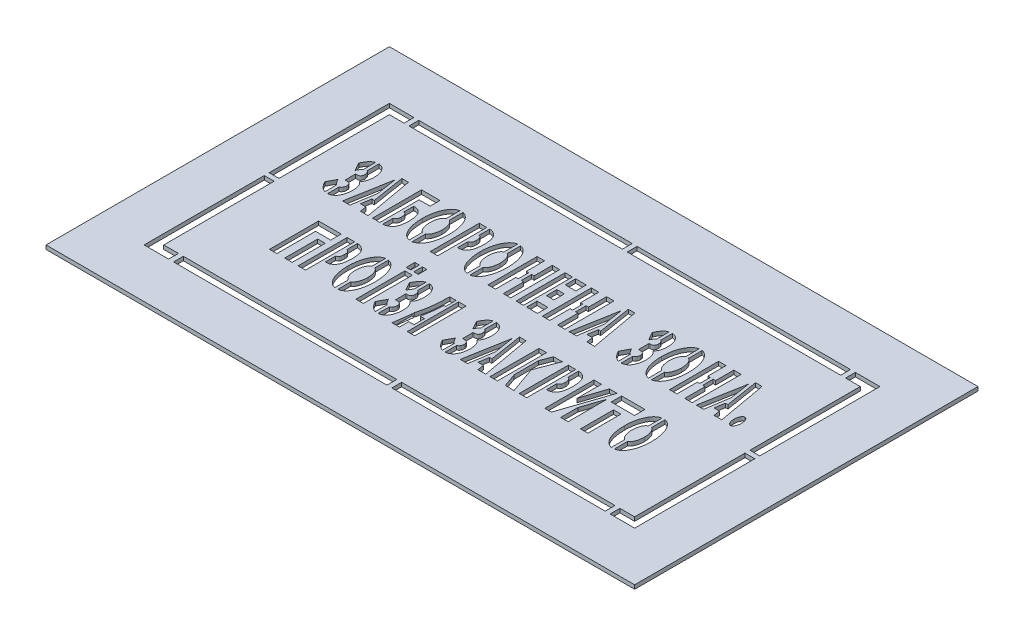
from build123d import *

# Parameters (mm, degrees)
SKETCH_1_W          = 600
SKETCH_1_H          = 350
SKETCH_1_W_2        = 500
SKETCH_1_H_2        = 250
SKETCH_1_W_3        = 10
SKETCH_1_H_3        = 5
SKETCH_1_W_4        = 5
SKETCH_1_H_4        = 10
SKETCH_1_W_5        = 480
SKETCH_1_H_5        = 230
EXTRUDE_1_DEPTH     = 4
SKETCH_2_W          = 7.563347397
SKETCH_2_H          = 50
SKETCH_2_W_2        = 11.097828713
SKETCH_2_H_2        = 10.655737705
SKETCH_2_W_3        = 7.582367444
SKETCH_2_W_4        = 10.891036874
SKETCH_2_H_3        = 10.655746801
SKETCH_2_W_5        = 7.563347398
SKETCH_2_H_4        = 49.999990904
SKETCH_2_W_6        = 7.61683275
SKETCH_2_H_5        = 33.667283264
SKETCH_2_W_7        = 4.687281693
SKETCH_2_H_6        = 8.756025288
SKETCH_2_W_8        = 4.652816386
SKETCH_2_H_7        = 52.384500745
SKETCH_2_W_9        = 23.762041482
CUT_EXTRUDE_1_DEPTH = 4


with BuildPart() as part:
    # Эскиз1 → Бобышка-Вытянуть1 (new body)
    # profile 1 of 10: a face of its own
    with BuildSketch(Plane(origin=(0, 0, 0), x_dir=(1, 0, 0), z_dir=(0, 1, 0))):
        with Locations((250, 125)):
            Rectangle(SKETCH_1_W, SKETCH_1_H)
        with Locations((250, 125)):
            Rectangle(SKETCH_1_W_2, SKETCH_1_H_2, mode=Mode.SUBTRACT)
    # profile 2 of 10: a face of its own
    with BuildSketch(Plane(origin=(0, 0, 0), x_dir=(1, 0, 0), z_dir=(0, 1, 0))):
        with Locations((5, 125)):
            Rectangle(SKETCH_1_W_3, SKETCH_1_H_3)
    # profile 3 of 10: a face of its own
    with BuildSketch(Plane(origin=(0, 0, 0), x_dir=(1, 0, 0), z_dir=(0, 1, 0))):
        with Locations((27.5, 245)):
            Rectangle(SKETCH_1_W_4, SKETCH_1_H_4)
    # profile 4 of 10: a face of its own
    with BuildSketch(Plane(origin=(0, 0, 0), x_dir=(1, 0, 0), z_dir=(0, 1, 0))):
        with Locations((250, 245)):
            Rectangle(SKETCH_1_W_4, SKETCH_1_H_4)
    # profile 5 of 10: a face of its own
    with BuildSketch(Plane(origin=(0, 0, 0), x_dir=(1, 0, 0), z_dir=(0, 1, 0))):
        with Locations((472.5, 245)):
            Rectangle(SKETCH_1_W_4, SKETCH_1_H_4)
    # profile 6 of 10: a face of its own
    with BuildSketch(Plane(origin=(0, 0, 0), x_dir=(1, 0, 0), z_dir=(0, 1, 0))):
        with Locations((495, 125)):
            Rectangle(SKETCH_1_W_3, SKETCH_1_H_3)
    # profile 7 of 10: a face of its own
    with BuildSketch(Plane(origin=(0, 0, 0), x_dir=(1, 0, 0), z_dir=(0, 1, 0))):
        with Locations((472.5, 5)):
            Rectangle(SKETCH_1_W_4, SKETCH_1_H_4)
    # profile 8 of 10: a face of its own
    with BuildSketch(Plane(origin=(0, 0, 0), x_dir=(1, 0, 0), z_dir=(0, 1, 0))):
        with Locations((250, 5)):
            Rectangle(SKETCH_1_W_4, SKETCH_1_H_4)
    # profile 9 of 10: a face of its own
    with BuildSketch(Plane(origin=(0, 0, 0), x_dir=(1, 0, 0), z_dir=(0, 1, 0))):
        with Locations((27.5, 5)):
            Rectangle(SKETCH_1_W_4, SKETCH_1_H_4)
    # profile 10 of 10: a face of its own
    with BuildSketch(Plane(origin=(0, 0, 0), x_dir=(1, 0, 0), z_dir=(0, 1, 0))):
        with Locations((250, 125)):
            Rectangle(SKETCH_1_W_5, SKETCH_1_H_5)
    extrude(amount=EXTRUDE_1_DEPTH)

    # Эскиз2 → Вырез-Вытянуть1 (cut)
    with BuildSketch(Plane(origin=(0, 4, 0), x_dir=(1, 0, 0), z_dir=(0, 1, 0))):
        with BuildLine():
            add(Edge.make_bspline(
                [(45.173865601, 190.835053718), (44.729965322, 190.666814347), (43.843523066, 190.330850406), (42.620940365, 189.571802544), (41.491175481, 188.634999114), (40.487507022, 187.494295019), (39.557910237, 186.219264899), (38.688259724, 184.830064512), (37.859750283, 183.339035865), (37.380958776, 182.28502375), (37.136736215, 181.747391952)],
                knots=[0, 0, 0, 0, 0.909975871, 1.817167281, 2.748710013, 3.719915223, 4.726614646, 5.777239659, 6.866211669, 8, 8, 8, 8], degree=3))
            Line((37.136736215, 181.747391952), (41.796265558, 173.327005446))
            add(Edge.make_bspline(
                [(41.796265558, 173.327005446), (42.050295521, 173.862854424), (42.535322724, 174.885967322), (43.371620396, 176.272934312), (44.212668411, 177.478357193), (44.859128752, 178.143742676), (45.165797317, 178.459388972)],
                knots=[0, 0, 0, 0, 1.151897454, 2.199353158, 3.145807174, 4, 4, 4, 4], degree=3))
            Line((45.165797317, 178.459388972), (45.173865601, 190.835053718))
        make_face()
        with BuildLine():
            add(Edge.make_bspline(
                [(48.206812579, 138.844998355), (48.591949245, 138.877636456), (49.347544495, 138.941668774), (50.438142044, 139.221646028), (51.460317612, 139.624249334), (52.416634073, 140.147789951), (53.30331644, 140.798895725), (54.11389301, 141.580331524), (54.866625898, 142.478996357), (55.527947645, 143.510100987), (56.131384337, 144.630269344), (56.653150829, 145.836734724), (57.090655168, 147.12104073), (57.450769835, 148.481673763), (57.742999265, 149.921045271), (57.94025376, 151.440183986), (58.07710398, 153.03466939), (58.094627593, 154.12351743), (58.103576751, 154.679582712)],
                knots=[0, 0, 0, 0, 0.897185724, 1.760178477, 2.605885542, 3.445720643, 4.287321635, 5.15515991, 6.057083176, 7.0059534, 7.997297909, 9.012295231, 10.057657283, 11.148354528, 12.282139955, 13.469253898, 14.70756984, 16, 16, 16, 16], degree=3))
            add(Edge.make_bspline(
                [(58.103576751, 154.679582712), (58.082554621, 155.372474708), (58.042562363, 156.690624441), (57.829690105, 158.567722843), (57.449307804, 160.231277173), (56.939445177, 161.696357701), (56.295065838, 162.964638352), (55.574585489, 164.076071163), (54.739078183, 165.018182324), (54.097064411, 165.518164488), (53.781669151, 165.763785395)],
                knots=[0, 0, 0, 0, 1.346679863, 2.561908223, 3.663875872, 4.656093446, 5.568013736, 6.421359663, 7.224478193, 8, 8, 8, 8], degree=3))
            add(Edge.make_bspline(
                [(53.781669151, 165.763785395), (54.065650228, 166.042426823), (54.647807621, 166.613638004), (55.398497097, 167.6329636), (56.022944448, 168.824109402), (56.580883187, 170.16339115), (57.016087976, 171.691055156), (57.328614428, 173.415631751), (57.506467129, 175.344701825), (57.537690096, 176.698591658), (57.554023845, 177.40685544)],
                knots=[0, 0, 0, 0, 0.757320362, 1.552496563, 2.399593948, 3.314818707, 4.312795502, 5.419839472, 6.650234156, 8, 8, 8, 8], degree=3))
            add(Edge.make_bspline(
                [(57.554023845, 177.40685544), (57.545021729, 177.89774012), (57.527440451, 178.856445787), (57.392311169, 180.255944519), (57.189117862, 181.584367273), (56.913250131, 182.839676755), (56.556706422, 184.026585413), (56.123349442, 185.140093909), (55.605877115, 186.182430613), (55.021777452, 187.149605186), (54.375173217, 188.033079758), (53.665291042, 188.817220377), (52.881776243, 189.479215578), (52.054060794, 190.054371908), (51.161444026, 190.514181089), (50.209220807, 190.859039876), (49.199985424, 191.105232362), (48.501623523, 191.181435408), (48.146423249, 191.220193741)],
                knots=[0, 0, 0, 0, 1.274277403, 2.488684242, 3.647004199, 4.761787014, 5.822660235, 6.861530427, 7.86012026, 8.840287556, 9.791521074, 10.698698302, 11.579158575, 12.448926406, 13.310587835, 14.177661952, 15.073123875, 16, 16, 16, 16], degree=3))
            Line((48.146423249, 191.220193741), (48.147514787, 179.119141717))
            add(Edge.make_bspline(
                [(48.147514787, 179.119141717), (48.315468205, 179.029114597), (48.654854241, 178.847195422), (49.102738903, 178.462817253), (49.513454936, 178.001603386), (49.848243714, 177.4418202), (50.129127618, 176.817254432), (50.333696086, 176.134999932), (50.454771562, 175.402278992), (50.474327934, 174.898617726), (50.484351714, 174.640461997)],
                knots=[0, 0, 0, 0, 0.857250508, 1.732259187, 2.645219547, 3.63238956, 4.660433193, 5.728153783, 6.835546519, 8, 8, 8, 8], degree=3))
            add(Edge.make_bspline(
                [(50.484351714, 174.640461997), (50.476033674, 174.344387244), (50.459914912, 173.770651273), (50.267846613, 172.955828733), (49.966440151, 172.220341451), (49.551100961, 171.571947229), (49.004770492, 171.03609975), (48.327300725, 170.66159869), (47.548882788, 170.409021912), (46.987358795, 170.3740973), (46.693368107, 170.355812221)],
                knots=[0, 0, 0, 0, 1.100423633, 2.132409517, 3.096367176, 4.048678111, 4.980705172, 5.912732232, 6.907193112, 8, 8, 8, 8], degree=3))
            Line((46.693368107, 170.355812221), (45.114567809, 170.36511758))
            Line((45.114567809, 170.36511758), (45.114567809, 159.709379876))
            Line((45.114567809, 159.709379876), (46.734437218, 159.709379876))
            add(Edge.make_bspline(
                [(46.734437218, 159.709379876), (47.078978325, 159.691689074), (47.729345673, 159.658295325), (48.639841074, 159.454214264), (49.420870577, 159.12508926), (50.057979378, 158.642598626), (50.556221271, 158.030610264), (50.901617212, 157.281746225), (51.107140724, 156.407478737), (51.126253495, 155.783009802), (51.136363636, 155.452682563)],
                knots=[0, 0, 0, 0, 1.181301018, 2.229863411, 3.183308299, 4.064851935, 4.942787953, 5.861911666, 6.869008888, 8, 8, 8, 8], degree=3))
            add(Edge.make_bspline(
                [(51.136363636, 155.452682563), (51.126004618, 155.163064852), (51.105901189, 154.601012616), (50.938757429, 153.788082885), (50.689805715, 153.029100657), (50.346836371, 152.33195046), (49.925921418, 151.71598343), (49.418806106, 151.211528731), (48.849477167, 150.806288458), (48.417901001, 150.643775445), (48.202309985, 150.562593145)],
                knots=[0, 0, 0, 0, 1.141275327, 2.214838123, 3.260447047, 4.284608276, 5.269809111, 6.187711255, 7.094683157, 8, 8, 8, 8], degree=3))
            Line((48.202309985, 150.562593145), (48.206812579, 138.844998355))
        make_face()
        with BuildLine():
            add(Edge.make_bspline(
                [(45.173865601, 151.209938743), (44.987808731, 151.344090148), (44.601947964, 151.622304888), (44.071160797, 152.132378694), (43.538477867, 152.70049637), (43.012216933, 153.341129736), (42.496320276, 154.055577247), (41.981931879, 154.840979307), (41.478260229, 155.698933288), (41.164007252, 156.304998232), (41.002235469, 156.616989568)],
                knots=[0, 0, 0, 0, 0.797680874, 1.654299315, 2.556751056, 3.508973598, 4.538153987, 5.623477983, 6.776609199, 8, 8, 8, 8], degree=3))
            Line((41.002235469, 156.616989568), (36.316281815, 147.861100721))
            add(Edge.make_bspline(
                [(36.316281815, 147.861100721), (36.602946796, 147.316030708), (37.161538476, 146.253914322), (38.123227913, 144.779271805), (39.125428522, 143.432904608), (40.185707277, 142.225071934), (41.309937678, 141.169458244), (42.521724688, 140.305456465), (43.80576302, 139.620458819), (44.713752489, 139.314180422), (45.165797317, 139.161698957)],
                knots=[0, 0, 0, 0, 1.157695126, 2.255869767, 3.306956767, 4.312228057, 5.275016411, 6.200239096, 7.103984532, 8, 8, 8, 8], degree=3))
            Line((45.165797317, 139.161698957), (45.173865601, 151.209938743))
        make_face()
        Polygon((77.957234276, 156.654247392), (75.51019751, 156.654247392), (73.855862795, 146.594625777), (79.473707765, 146.594625777), (80.473201655, 140.037248728), (88.331291551, 140.037248728), (79.404777152, 190.037248728), (72.718507679, 190.037248728), align=None)
        Polygon((73.649070956, 164.689657606), (70.374866832, 185.333475718), (62.309985097, 140.037248728), (69.754491314, 140.037248728), align=None)
        Polygon((100.309249037, 179.977627113), (111.548131724, 179.977627113), (111.548131724, 190.037248728), (92.745901639, 190.037248728), (92.745901639, 140.037248728), (100.309249037, 140.037248728), align=None)
        with BuildLine():
            add(Edge.make_bspline(
                [(106.447266353, 156.121922591), (106.431422761, 155.671536039), (106.401986517, 154.834750501), (106.23187907, 153.676452784), (105.952315403, 152.710702977), (105.556195492, 151.934782918), (105.074067845, 151.329834042), (104.51727578, 150.887375068), (103.914344499, 150.545980875), (103.467769423, 150.457857848), (103.243293592, 150.413561848)],
                knots=[0, 0, 0, 0, 1.509562623, 2.80465783, 3.913987701, 4.863428978, 5.706877676, 6.483697873, 7.237814205, 8, 8, 8, 8], degree=3))
            Line((103.243293592, 150.413561848), (103.244539764, 140.037248728))
            add(Edge.make_bspline(
                [(103.244539764, 140.037248728), (103.570459837, 140.036424308), (104.222063979, 140.034776065), (105.191074887, 140.158564255), (106.139334273, 140.390283664), (107.057331718, 140.746766025), (107.962995809, 141.180042293), (108.846254921, 141.72686669), (109.700504834, 142.38588218), (110.550634235, 143.137127526), (111.351434583, 144.048499005), (112.028535751, 145.177310946), (112.598647119, 146.506625917), (113.090741867, 148.027582319), (113.47568185, 149.749188804), (113.757597842, 151.670346348), (113.952217388, 153.791159366), (114.002977445, 155.275280868), (114.029433681, 156.04880775)],
                knots=[0, 0, 0, 0, 0.716844696, 1.433170313, 2.144292885, 2.860227139, 3.596902489, 4.351804127, 5.141897985, 5.969444186, 6.846427479, 7.800576858, 8.853298528, 10.024742617, 11.314646678, 12.731660118, 14.296535188, 16, 16, 16, 16], degree=3))
            add(Edge.make_bspline(
                [(114.029433681, 156.04880775), (114.008396259, 156.760158623), (113.968011076, 158.125726869), (113.799830879, 160.087582002), (113.552969032, 161.879567703), (113.22353582, 163.502769258), (112.806249153, 164.95563719), (112.309104684, 166.24349625), (111.714746582, 167.357394085), (111.036658765, 168.306761932), (110.286802239, 169.090864496), (109.539205228, 169.795921496), (108.736589098, 170.361707219), (107.919024139, 170.838238341), (107.059850682, 171.180086298), (106.181136994, 171.430353708), (105.267947621, 171.550335038), (104.653144879, 171.548825548), (104.342399404, 171.548062593)],
                knots=[0, 0, 0, 0, 1.663893055, 3.194147365, 4.601841411, 5.891889288, 7.063703187, 8.132842981, 9.113844069, 10.008483177, 10.85099128, 11.647542875, 12.407138584, 13.141973132, 13.855184798, 14.563278451, 15.273824449, 16, 16, 16, 16], degree=3))
            Line((104.342399404, 171.548062593), (103.244539764, 171.549399727))
            Line((103.244539764, 171.549399727), (103.244539764, 161.50572366))
            add(Edge.make_bspline(
                [(103.244539764, 161.50572366), (103.46390972, 161.468742749), (103.897825092, 161.395594235), (104.504368403, 161.125504164), (105.051194963, 160.728472126), (105.546821792, 160.197685262), (105.961003911, 159.477992268), (106.233281851, 158.542559531), (106.404497012, 157.399460882), (106.426345441, 156.564960667), (106.438152012, 156.114008942)],
                knots=[0, 0, 0, 0, 0.767082299, 1.517294383, 2.271339972, 3.092032667, 4.011164819, 5.115011853, 6.440994555, 8, 8, 8, 8], degree=3))
            Line((106.438152012, 156.114008942), (106.447266353, 156.121922591))
        make_face()
        with BuildLine():
            add(Edge.make_bspline(
                [(130.734932412, 191.229499101), (130.277753123, 191.101865921), (129.366339855, 190.847421819), (128.069686677, 190.247727746), (126.844646375, 189.471998122), (125.68482086, 188.516676067), (124.601148292, 187.366122425), (123.58713671, 186.035714435), (122.638661332, 184.527838462), (121.756599945, 182.857383271), (120.976137108, 181.034147297), (120.272966341, 179.099189399), (119.693037407, 177.048334742), (119.194173568, 174.89586896), (118.818172769, 172.63029359), (118.543803639, 170.258222966), (118.348703514, 167.781929546), (118.31713055, 166.093277887), (118.301043219, 165.232861401)],
                knots=[0, 0, 0, 0, 0.738982431, 1.473204074, 2.217108737, 2.994217883, 3.808998121, 4.675402626, 5.597853773, 6.5829345, 7.616928788, 8.687082448, 9.790016956, 10.937094495, 12.129824664, 13.367716094, 14.6587758, 16, 16, 16, 16], degree=3))
            add(Edge.make_bspline(
                [(118.301043219, 165.232861401), (118.317878843, 164.350756359), (118.350871608, 162.622095475), (118.534447474, 160.093044318), (118.794700116, 157.682254486), (119.179418048, 155.397695453), (119.657568029, 153.234573122), (120.250848236, 151.196806503), (120.919760968, 149.273092901), (121.713687054, 147.489798828), (122.579632646, 145.854958904), (123.521801186, 144.389083522), (124.539006041, 143.10343528), (125.629349533, 141.996677709), (126.795088563, 141.071327852), (128.032639994, 140.327735506), (129.34696011, 139.766570268), (130.266248084, 139.543505013), (130.726527571, 139.431818182)],
                knots=[0, 0, 0, 0, 1.377191256, 2.69888113, 3.957371036, 5.161484402, 6.313969955, 7.413932197, 8.473328788, 9.491143687, 10.458331193, 11.359167715, 12.207798768, 13.013289368, 13.779414831, 14.525102454, 15.261531637, 16, 16, 16, 16], degree=3))
            Line((130.726527571, 139.431818182), (130.734932412, 153.048870695))
            add(Edge.make_bspline(
                [(130.734932412, 153.048870695), (130.554975102, 153.149713261), (130.191533076, 153.353375045), (129.695948272, 153.75847089), (129.223596972, 154.218693995), (128.782388178, 154.754724877), (128.349530086, 155.34450859), (127.968760729, 156.021485102), (127.587851509, 156.749829152), (127.131126713, 157.830771521), (126.633251794, 159.287939173), (126.223933425, 161.159942052), (125.956514405, 163.154407616), (125.914118847, 164.527173953), (125.892324888, 165.232861401)],
                knots=[0, 0, 0, 0, 0.543116293, 1.096878403, 1.681736217, 2.280418616, 2.925832582, 3.608410981, 4.326232236, 5.092884805, 6.701007953, 8.379721118, 10.138951041, 12, 12, 12, 12], degree=3))
            add(Edge.make_bspline(
                [(125.892324888, 165.232861401), (125.91345773, 166.003685469), (125.953807951, 167.475466753), (126.216352116, 169.576829466), (126.624591381, 171.464594936), (127.112129236, 172.889995528), (127.582273409, 173.899297612), (127.942121967, 174.581193346), (128.350254365, 175.183055307), (128.758037698, 175.737926202), (129.216480575, 176.207948679), (129.689476759, 176.616490386), (130.184487744, 176.974918213), (130.546489805, 177.145195319), (130.726527571, 177.229880775)],
                knots=[0, 0, 0, 0, 2.044771279, 3.904206187, 5.608856245, 7.16142789, 7.887448302, 8.561922998, 9.203876636, 9.815078083, 10.38598824, 10.94080639, 11.473221642, 12, 12, 12, 12], degree=3))
            Line((130.726527571, 177.229880775), (130.734932412, 191.229499101))
        make_face()
        with BuildLine():
            add(Edge.make_bspline(
                [(138.578413894, 165.23780061), (138.552282897, 164.512013629), (138.501479736, 163.100958636), (138.244580019, 161.055722231), (137.815769201, 159.153335957), (137.326374236, 157.676508172), (136.860277008, 156.590610777), (136.491651492, 155.85355453), (136.087581238, 155.190647056), (135.670967425, 154.593794607), (135.233742828, 154.061186291), (134.753540478, 153.617713726), (134.261294903, 153.228201253), (133.908399584, 153.020936023), (133.73509687, 152.919150522)],
                knots=[0, 0, 0, 0, 1.896915131, 3.687929986, 5.376439205, 6.984869497, 7.7443386, 8.462661774, 9.136016266, 9.770682422, 10.363755221, 10.931892983, 11.475465287, 12, 12, 12, 12], degree=3))
            Line((133.73509687, 152.919150522), (133.735860947, 139.441123542))
            add(Edge.make_bspline(
                [(133.735860947, 139.441123542), (134.19001518, 139.538739522), (135.098279975, 139.733962095), (136.388548148, 140.283213626), (137.615609426, 140.999680563), (138.772552901, 141.900084691), (139.860143298, 142.984827521), (140.877099465, 144.252342929), (141.822751463, 145.703887277), (142.706959054, 147.320679208), (143.490954126, 149.103000822), (144.190885399, 151.017986245), (144.772381154, 153.071890114), (145.267655365, 155.247120615), (145.646367276, 157.558869743), (145.918214579, 159.999630116), (146.113583695, 162.572104366), (146.144670658, 164.332087509), (146.160581222, 165.232861401)],
                knots=[0, 0, 0, 0, 0.723176859, 1.446284178, 2.175576638, 2.935055034, 3.726133478, 4.566454112, 5.465083679, 6.425192146, 7.437678153, 8.499410138, 9.603050717, 10.765028311, 11.977628507, 13.254797401, 14.594982663, 16, 16, 16, 16], degree=3))
            add(Edge.make_bspline(
                [(146.160581222, 165.232861401), (146.139261695, 166.121080232), (146.097552577, 167.858774706), (145.924493973, 170.40827889), (145.632464068, 172.834617669), (145.258880107, 175.144031487), (144.763168434, 177.326543642), (144.169531932, 179.389865603), (143.471630546, 181.332465565), (142.67648892, 183.141707809), (141.798341177, 184.797315643), (140.845613869, 186.278036453), (139.835663651, 187.581609885), (138.748105042, 188.691616059), (137.596388397, 189.616340195), (136.374903632, 190.349054588), (135.08828178, 190.906444307), (134.18631795, 191.115573628), (133.73509687, 191.220193741)],
                knots=[0, 0, 0, 0, 1.380756443, 2.701285716, 3.969575717, 5.177765761, 6.335517313, 7.445754528, 8.512698698, 9.54110437, 10.514706095, 11.422195093, 12.274563479, 13.073022882, 13.831905344, 14.563463614, 15.281350896, 16, 16, 16, 16], degree=3))
            Line((133.73509687, 191.220193741), (133.735860947, 177.297747139))
            add(Edge.make_bspline(
                [(133.735860947, 177.297747139), (133.908594548, 177.21716115), (134.256331652, 177.054930188), (134.746673793, 176.730067807), (135.210930042, 176.338279992), (135.653262554, 175.875312491), (136.068817193, 175.34163317), (136.473366171, 174.744387767), (136.841991563, 174.071876974), (137.186294794, 173.33414333), (137.503090661, 172.532578735), (137.783956524, 171.66557947), (138.010387873, 170.736273044), (138.207789114, 169.751461571), (138.367699547, 168.707522671), (138.473379545, 167.600299797), (138.552955693, 166.43554636), (138.56377032, 165.639737459), (138.569299553, 165.232861401)],
                knots=[0, 0, 0, 0, 0.669509355, 1.347816765, 2.06073793, 2.802019789, 3.594891591, 4.436691431, 5.335931871, 6.288344703, 7.297985186, 8.364856054, 9.490231354, 10.659296946, 11.896089912, 13.201890443, 14.569400538, 16, 16, 16, 16], degree=3))
            Line((138.569299553, 165.232861401), (138.578413894, 165.23780061))
        make_face()
        with Locations((155.424743744, 165.037248728)):
            Rectangle(SKETCH_2_W, SKETCH_2_H)
        with BuildLine():
            add(Edge.make_bspline(
                [(165.344434758, 173.425826003), (165.328785521, 172.957595886), (165.299913527, 172.093736691), (165.131550068, 170.91107748), (164.858318655, 169.949220385), (164.450249091, 169.208124328), (163.944566538, 168.677150865), (163.40674631, 168.267322012), (162.794710072, 168.004953053), (162.360152077, 167.951674221), (162.140461997, 167.924739195)],
                knots=[0, 0, 0, 0, 1.589731882, 2.932969188, 4.046675956, 4.967167437, 5.772742981, 6.519103575, 7.251335245, 8, 8, 8, 8], degree=3))
            Line((162.140461997, 167.924739195), (162.141708169, 157.373379794))
            Line((162.141708169, 157.373379794), (163.242442192, 157.373379794))
            add(Edge.make_bspline(
                [(163.242442192, 157.373379794), (163.552561238, 157.373158765), (164.168384308, 157.372719852), (165.079560698, 157.529569644), (165.962906992, 157.80086254), (166.817086346, 158.197438923), (167.641339324, 158.715628828), (168.433185246, 159.35204536), (169.193337758, 160.110773528), (169.93367777, 160.980767561), (170.606916671, 162.00853905), (171.206552811, 163.189784888), (171.7027991, 164.542603841), (172.117684742, 166.054457772), (172.450297755, 167.729407874), (172.696692019, 169.567970617), (172.864509767, 171.570086913), (172.905404868, 172.960419735), (172.926602086, 173.681073025)],
                knots=[0, 0, 0, 0, 0.703215071, 1.396418791, 2.090052717, 2.796752448, 3.528477028, 4.296016652, 5.098764613, 5.964564297, 6.8856777, 7.882162628, 8.96657357, 10.152110749, 11.439539529, 12.841601804, 14.362902743, 16, 16, 16, 16], degree=3))
            add(Edge.make_bspline(
                [(172.926602086, 173.681073025), (172.900140171, 174.470118179), (172.849328567, 175.985225797), (172.654357259, 178.152460658), (172.373473026, 180.11715941), (171.988485891, 181.875839771), (171.497909746, 183.425579919), (170.922574901, 184.776725355), (170.251872329, 185.930681578), (169.44745013, 186.861455843), (168.60059943, 187.632255509), (167.743881987, 188.301632881), (166.8573202, 188.853198108), (165.961673986, 189.316131694), (165.03235011, 189.65031192), (164.089440808, 189.898340015), (163.11930726, 190.032498929), (162.466827626, 190.029462279), (162.140461997, 190.027943368)],
                knots=[0, 0, 0, 0, 1.714807494, 3.292736651, 4.724513019, 6.023810364, 7.19914469, 8.250417307, 9.209354504, 10.085073802, 10.910847616, 11.694677959, 12.443239047, 13.176231877, 13.880418914, 14.583862609, 15.291658241, 16, 16, 16, 16], degree=3))
            Line((162.140461997, 190.027943368), (162.141708169, 179.246542372))
            add(Edge.make_bspline(
                [(162.141708169, 179.246542372), (162.364814473, 179.19531944), (162.806487633, 179.093915786), (163.423528615, 178.772339079), (163.967486755, 178.303738923), (164.454120951, 177.693272769), (164.850985518, 176.904082301), (165.129171119, 175.91972094), (165.300972178, 174.736395324), (165.323310606, 173.880450154), (165.335320417, 173.420268256)],
                knots=[0, 0, 0, 0, 0.754341111, 1.493333966, 2.272563698, 3.112421979, 4.057937244, 5.171675651, 6.479407662, 8, 8, 8, 8], degree=3))
            Line((165.335320417, 173.420268256), (165.344434758, 173.425826003))
        make_face()
        with BuildLine():
            add(Edge.make_bspline(
                [(189.632100817, 191.229499101), (189.174921528, 191.101865921), (188.26350826, 190.847421819), (186.966855082, 190.247727746), (185.741814781, 189.471998122), (184.581989265, 188.516676067), (183.498316697, 187.366122425), (182.484305115, 186.035714435), (181.535829737, 184.527838462), (180.653768351, 182.857383271), (179.873305514, 181.034147297), (179.170134746, 179.099189399), (178.590205812, 177.048334742), (178.091341973, 174.89586896), (177.715341174, 172.63029359), (177.440972044, 170.258222966), (177.245871919, 167.781929546), (177.214298956, 166.093277887), (177.198211624, 165.232861401)],
                knots=[0, 0, 0, 0, 0.738982431, 1.473204074, 2.217108737, 2.994217883, 3.808998121, 4.675402626, 5.597853773, 6.5829345, 7.616928788, 8.687082448, 9.790016956, 10.937094495, 12.129824664, 13.367716094, 14.6587758, 16, 16, 16, 16], degree=3))
            add(Edge.make_bspline(
                [(177.198211624, 165.232861401), (177.215047248, 164.350756359), (177.248040013, 162.622095475), (177.431615879, 160.093044318), (177.691868521, 157.682254486), (178.076586454, 155.397695453), (178.554736434, 153.234573122), (179.148016642, 151.196806503), (179.816929373, 149.273092901), (180.61085546, 147.489798828), (181.476801051, 145.854958904), (182.418969591, 144.389083522), (183.436174446, 143.10343528), (184.526517939, 141.996677709), (185.692256968, 141.071327852), (186.929808399, 140.327735506), (188.244128515, 139.766570268), (189.163416489, 139.543505013), (189.623695976, 139.431818182)],
                knots=[0, 0, 0, 0, 1.377191256, 2.69888113, 3.957371036, 5.161484402, 6.313969955, 7.413932197, 8.473328788, 9.491143687, 10.458331193, 11.359167715, 12.207798768, 13.013289368, 13.779414831, 14.525102454, 15.261531637, 16, 16, 16, 16], degree=3))
            Line((189.623695976, 139.431818182), (189.632100817, 153.048870695))
            add(Edge.make_bspline(
                [(189.632100817, 153.048870695), (189.452143508, 153.149713261), (189.088701481, 153.353375045), (188.593116678, 153.75847089), (188.120765377, 154.218693995), (187.679556584, 154.754724877), (187.246698491, 155.34450859), (186.865929134, 156.021485102), (186.485019914, 156.749829152), (186.028295119, 157.830771521), (185.530420199, 159.287939173), (185.12110183, 161.159942052), (184.85368281, 163.154407616), (184.811287252, 164.527173953), (184.789493294, 165.232861401)],
                knots=[0, 0, 0, 0, 0.543116293, 1.096878403, 1.681736217, 2.280418616, 2.925832582, 3.608410981, 4.326232236, 5.092884805, 6.701007953, 8.379721118, 10.138951041, 12, 12, 12, 12], degree=3))
            add(Edge.make_bspline(
                [(184.789493294, 165.232861401), (184.810626136, 166.003685469), (184.850976357, 167.475466753), (185.113520521, 169.576829466), (185.521759786, 171.464594936), (186.009297642, 172.889995528), (186.479441815, 173.899297612), (186.839290372, 174.581193346), (187.247422771, 175.183055307), (187.655206103, 175.737926202), (188.113648981, 176.207948679), (188.586645164, 176.616490386), (189.081656149, 176.974918213), (189.44365821, 177.145195319), (189.623695976, 177.229880775)],
                knots=[0, 0, 0, 0, 2.044771279, 3.904206187, 5.608856245, 7.16142789, 7.887448302, 8.561922998, 9.203876636, 9.815078083, 10.38598824, 10.94080639, 11.473221642, 12, 12, 12, 12], degree=3))
            Line((189.623695976, 177.229880775), (189.632100817, 191.229499101))
        make_face()
        with BuildLine():
            add(Edge.make_bspline(
                [(197.475582299, 165.23780061), (197.449451303, 164.512013629), (197.398648141, 163.100958636), (197.141748425, 161.055722231), (196.712937606, 159.153335957), (196.223542642, 157.676508172), (195.757445413, 156.590610777), (195.388819898, 155.85355453), (194.984749643, 155.190647056), (194.568135831, 154.593794607), (194.130911233, 154.061186291), (193.650708884, 153.617713726), (193.158463309, 153.228201253), (192.80556799, 153.020936023), (192.632265276, 152.919150522)],
                knots=[0, 0, 0, 0, 1.896915131, 3.687929986, 5.376439205, 6.984869497, 7.7443386, 8.462661774, 9.136016266, 9.770682422, 10.363755221, 10.931892983, 11.475465287, 12, 12, 12, 12], degree=3))
            Line((192.632265276, 152.919150522), (192.633029352, 139.441123542))
            add(Edge.make_bspline(
                [(192.633029352, 139.441123542), (193.087183585, 139.538739522), (193.995448381, 139.733962095), (195.285716553, 140.283213626), (196.512777831, 140.999680563), (197.669721306, 141.900084691), (198.757311704, 142.984827521), (199.774267871, 144.252342929), (200.719919868, 145.703887277), (201.60412746, 147.320679208), (202.388122531, 149.103000822), (203.088053805, 151.017986245), (203.66954956, 153.071890114), (204.16482377, 155.247120615), (204.543535682, 157.558869743), (204.815382984, 159.999630116), (205.0107521, 162.572104366), (205.041839063, 164.332087509), (205.057749627, 165.232861401)],
                knots=[0, 0, 0, 0, 0.723176859, 1.446284178, 2.175576638, 2.935055034, 3.726133478, 4.566454112, 5.465083679, 6.425192146, 7.437678153, 8.499410138, 9.603050717, 10.765028311, 11.977628507, 13.254797401, 14.594982663, 16, 16, 16, 16], degree=3))
            add(Edge.make_bspline(
                [(205.057749627, 165.232861401), (205.036430101, 166.121080232), (204.994720983, 167.858774706), (204.821662379, 170.40827889), (204.529632473, 172.834617669), (204.156048512, 175.144031487), (203.66033684, 177.326543642), (203.066700338, 179.389865603), (202.368798951, 181.332465565), (201.573657326, 183.141707809), (200.695509582, 184.797315643), (199.742782275, 186.278036453), (198.732832057, 187.581609885), (197.645273447, 188.691616059), (196.493556802, 189.616340195), (195.272072038, 190.349054588), (193.985450186, 190.906444307), (193.083486355, 191.115573628), (192.632265276, 191.220193741)],
                knots=[0, 0, 0, 0, 1.380756443, 2.701285716, 3.969575717, 5.177765761, 6.335517313, 7.445754528, 8.512698698, 9.54110437, 10.514706095, 11.422195093, 12.274563479, 13.073022882, 13.831905344, 14.563463614, 15.281350896, 16, 16, 16, 16], degree=3))
            Line((192.632265276, 191.220193741), (192.633029352, 177.297747139))
            add(Edge.make_bspline(
                [(192.633029352, 177.297747139), (192.805762954, 177.21716115), (193.153500057, 177.054930188), (193.643842198, 176.730067807), (194.108098447, 176.338279992), (194.55043096, 175.875312491), (194.965985598, 175.34163317), (195.370534577, 174.744387767), (195.739159968, 174.071876974), (196.083463199, 173.33414333), (196.400259066, 172.532578735), (196.681124929, 171.66557947), (196.907556279, 170.736273044), (197.104957519, 169.751461571), (197.264867952, 168.707522671), (197.370547951, 167.600299797), (197.450124099, 166.43554636), (197.460938725, 165.639737459), (197.466467958, 165.232861401)],
                knots=[0, 0, 0, 0, 0.669509355, 1.347816765, 2.06073793, 2.802019789, 3.594891591, 4.436691431, 5.335931871, 6.288344703, 7.297985186, 8.364856054, 9.490231354, 10.659296946, 11.896089912, 13.201890443, 14.569400538, 16, 16, 16, 16], degree=3))
            Line((197.466467958, 165.232861401), (197.475582299, 165.23780061))
        make_face()
        Polygon((223.560629104, 160.901630248), (226.039493294, 160.901630248), (226.039493294, 140.037248728), (233.602840691, 140.037248728), (233.602840691, 190.037248728), (226.039493294, 190.037248728), (226.039493294, 171.557367953), (223.560629104, 171.557367953), align=None)
        Polygon((218.113091322, 140.037248728), (218.113091322, 160.901630248), (220.557499301, 160.901630248), (220.557499301, 171.557367953), (218.113091322, 171.557367953), (218.113091322, 190.037248728), (210.530723879, 190.037248728), (210.530723879, 140.037248728), align=None)
        with Locations((255.364288012, 145.365126677)):
            Rectangle(SKETCH_2_W_2, SKETCH_2_H_2)
        with Locations((253.606557377, 165.633373914)):
            Rectangle(SKETCH_2_W_3, SKETCH_2_H_2)
        with Locations((255.260892092, 184.709375328)):
            Rectangle(SKETCH_2_W_4, SKETCH_2_H_3)
        with Locations((242.876308572, 165.037253276)):
            Rectangle(SKETCH_2_W_5, SKETCH_2_H_4)
        Polygon((278.881046392, 160.901630248), (281.359910581, 160.901630248), (281.359910581, 140.037248728), (288.923257978, 140.037248728), (288.923257978, 190.037248728), (281.359910581, 190.037248728), (281.359910581, 171.557367953), (278.881046392, 171.557367953), align=None)
        Polygon((273.43350861, 140.037248728), (273.43350861, 160.901630248), (275.877916589, 160.901630248), (275.877916589, 171.557367953), (273.43350861, 171.557367953), (273.43350861, 190.037248728), (265.851141166, 190.037248728), (265.851141166, 140.037248728), align=None)
        Polygon((308.776906407, 156.654247392), (306.329869641, 156.654247392), (304.675534926, 146.594625777), (310.293379896, 146.594625777), (311.292873786, 140.037248728), (319.150963682, 140.037248728), (310.224449283, 190.037248728), (303.53817981, 190.037248728), align=None)
        Polygon((304.468743087, 164.689657606), (301.194538964, 185.333475718), (293.129657228, 140.037248728), (300.574163445, 140.037248728), align=None)
        with BuildLine():
            add(Edge.make_bspline(
                [(344.3690966, 190.835053718), (343.92519632, 190.666814347), (343.038754065, 190.330850406), (341.816171364, 189.571802544), (340.686406479, 188.634999114), (339.682738021, 187.494295019), (338.753141235, 186.219264899), (337.883490723, 184.830064512), (337.054981282, 183.339035865), (336.576189775, 182.28502375), (336.331967213, 181.747391952)],
                knots=[0, 0, 0, 0, 0.909975871, 1.817167281, 2.748710013, 3.719915223, 4.726614646, 5.777239659, 6.866211669, 8, 8, 8, 8], degree=3))
            Line((336.331967213, 181.747391952), (340.991496557, 173.327005446))
            add(Edge.make_bspline(
                [(340.991496557, 173.327005446), (341.245526519, 173.862854424), (341.730553722, 174.885967322), (342.566851395, 176.272934312), (343.40789941, 177.478357193), (344.05435975, 178.143742676), (344.361028316, 178.459388972)],
                knots=[0, 0, 0, 0, 1.151897454, 2.199353158, 3.145807174, 4, 4, 4, 4], degree=3))
            Line((344.361028316, 178.459388972), (344.3690966, 190.835053718))
        make_face()
        with BuildLine():
            add(Edge.make_bspline(
                [(347.402043577, 138.844998355), (347.787180244, 138.877636456), (348.542775493, 138.941668774), (349.633373042, 139.221646028), (350.655548611, 139.624249334), (351.611865071, 140.147789951), (352.498547438, 140.798895725), (353.309124008, 141.580331524), (354.061856896, 142.478996357), (354.723178643, 143.510100987), (355.326615336, 144.630269344), (355.848381828, 145.836734724), (356.285886166, 147.12104073), (356.646000834, 148.481673763), (356.938230263, 149.921045271), (357.135484758, 151.440183986), (357.272334979, 153.03466939), (357.289858592, 154.12351743), (357.29880775, 154.679582712)],
                knots=[0, 0, 0, 0, 0.897185724, 1.760178477, 2.605885542, 3.445720643, 4.287321635, 5.15515991, 6.057083176, 7.0059534, 7.997297909, 9.012295231, 10.057657283, 11.148354528, 12.282139955, 13.469253898, 14.70756984, 16, 16, 16, 16], degree=3))
            add(Edge.make_bspline(
                [(357.29880775, 154.679582712), (357.27778562, 155.372474708), (357.237793362, 156.690624441), (357.024921103, 158.567722843), (356.644538802, 160.231277173), (356.134676176, 161.696357701), (355.490296836, 162.964638352), (354.769816488, 164.076071163), (353.934309182, 165.018182324), (353.29229541, 165.518164488), (352.976900149, 165.763785395)],
                knots=[0, 0, 0, 0, 1.346679863, 2.561908223, 3.663875872, 4.656093446, 5.568013736, 6.421359663, 7.224478193, 8, 8, 8, 8], degree=3))
            add(Edge.make_bspline(
                [(352.976900149, 165.763785395), (353.260881227, 166.042426823), (353.843038619, 166.613638004), (354.593728095, 167.6329636), (355.218175447, 168.824109402), (355.776114186, 170.16339115), (356.211318975, 171.691055156), (356.523845427, 173.415631751), (356.701698128, 175.344701825), (356.732921095, 176.698591658), (356.749254844, 177.40685544)],
                knots=[0, 0, 0, 0, 0.757320362, 1.552496563, 2.399593948, 3.314818707, 4.312795502, 5.419839472, 6.650234156, 8, 8, 8, 8], degree=3))
            add(Edge.make_bspline(
                [(356.749254844, 177.40685544), (356.740252727, 177.89774012), (356.72267145, 178.856445787), (356.587542167, 180.255944519), (356.38434886, 181.584367273), (356.108481129, 182.839676755), (355.75193742, 184.026585413), (355.318580441, 185.140093909), (354.801108113, 186.182430613), (354.21700845, 187.149605186), (353.570404216, 188.033079758), (352.86052204, 188.817220377), (352.077007241, 189.479215578), (351.249291792, 190.054371908), (350.356675025, 190.514181089), (349.404451805, 190.859039876), (348.395216423, 191.105232362), (347.696854521, 191.181435408), (347.341654247, 191.220193741)],
                knots=[0, 0, 0, 0, 1.274277403, 2.488684242, 3.647004199, 4.761787014, 5.822660235, 6.861530427, 7.86012026, 8.840287556, 9.791521074, 10.698698302, 11.579158575, 12.448926406, 13.310587835, 14.177661952, 15.073123875, 16, 16, 16, 16], degree=3))
            Line((347.341654247, 191.220193741), (347.342745785, 179.119141717))
            add(Edge.make_bspline(
                [(347.342745785, 179.119141717), (347.510699203, 179.029114597), (347.850085239, 178.847195422), (348.297969902, 178.462817253), (348.708685934, 178.001603386), (349.043474713, 177.4418202), (349.324358616, 176.817254432), (349.528927084, 176.134999932), (349.65000256, 175.402278992), (349.669558933, 174.898617726), (349.679582712, 174.640461997)],
                knots=[0, 0, 0, 0, 0.857250508, 1.732259187, 2.645219547, 3.63238956, 4.660433193, 5.728153783, 6.835546519, 8, 8, 8, 8], degree=3))
            add(Edge.make_bspline(
                [(349.679582712, 174.640461997), (349.671264673, 174.344387244), (349.65514591, 173.770651273), (349.463077611, 172.955828733), (349.161671149, 172.220341451), (348.74633196, 171.571947229), (348.20000149, 171.03609975), (347.522531723, 170.66159869), (346.744113787, 170.409021912), (346.182589794, 170.3740973), (345.888599106, 170.355812221)],
                knots=[0, 0, 0, 0, 1.100423633, 2.132409517, 3.096367176, 4.048678111, 4.980705172, 5.912732232, 6.907193112, 8, 8, 8, 8], degree=3))
            Line((345.888599106, 170.355812221), (344.309798808, 170.36511758))
            Line((344.309798808, 170.36511758), (344.309798808, 159.709379876))
            Line((344.309798808, 159.709379876), (345.929668216, 159.709379876))
            add(Edge.make_bspline(
                [(345.929668216, 159.709379876), (346.274209324, 159.691689074), (346.924576671, 159.658295325), (347.835072072, 159.454214264), (348.616101576, 159.12508926), (349.253210376, 158.642598626), (349.75145227, 158.030610264), (350.096848211, 157.281746225), (350.302371722, 156.407478737), (350.321484494, 155.783009802), (350.331594635, 155.452682563)],
                knots=[0, 0, 0, 0, 1.181301018, 2.229863411, 3.183308299, 4.064851935, 4.942787953, 5.861911666, 6.869008888, 8, 8, 8, 8], degree=3))
            add(Edge.make_bspline(
                [(350.331594635, 155.452682563), (350.321235617, 155.163064852), (350.301132187, 154.601012616), (350.133988427, 153.788082885), (349.885036714, 153.029100657), (349.542067369, 152.33195046), (349.121152416, 151.71598343), (348.614037105, 151.211528731), (348.044708165, 150.806288458), (347.613132, 150.643775445), (347.397540984, 150.562593145)],
                knots=[0, 0, 0, 0, 1.141275327, 2.214838123, 3.260447047, 4.284608276, 5.269809111, 6.187711255, 7.094683157, 8, 8, 8, 8], degree=3))
            Line((347.397540984, 150.562593145), (347.402043577, 138.844998355))
        make_face()
        with BuildLine():
            add(Edge.make_bspline(
                [(344.3690966, 151.209938743), (344.183039729, 151.344090148), (343.797178963, 151.622304888), (343.266391796, 152.132378694), (342.733708866, 152.70049637), (342.207447931, 153.341129736), (341.691551275, 154.055577247), (341.177162878, 154.840979307), (340.673491228, 155.698933288), (340.35923825, 156.304998232), (340.197466468, 156.616989568)],
                knots=[0, 0, 0, 0, 0.797680874, 1.654299315, 2.556751056, 3.508973598, 4.538153987, 5.623477983, 6.776609199, 8, 8, 8, 8], degree=3))
            Line((340.197466468, 156.616989568), (335.511512813, 147.861100721))
            add(Edge.make_bspline(
                [(335.511512813, 147.861100721), (335.798177795, 147.316030708), (336.356769474, 146.253914322), (337.318458911, 144.779271805), (338.32065952, 143.432904608), (339.380938275, 142.225071934), (340.505168676, 141.169458244), (341.716955686, 140.305456465), (343.000994018, 139.620458819), (343.908983487, 139.314180422), (344.361028316, 139.161698957)],
                knots=[0, 0, 0, 0, 1.157695126, 2.255869767, 3.306956767, 4.312228057, 5.275016411, 6.200239096, 7.103984532, 8, 8, 8, 8], degree=3))
            Line((344.361028316, 139.161698957), (344.3690966, 151.209938743))
        make_face()
        with BuildLine():
            add(Edge.make_bspline(
                [(374.609746123, 191.229499101), (374.152566833, 191.101865921), (373.241153566, 190.847421819), (371.944500388, 190.247727746), (370.719460086, 189.471998122), (369.55963457, 188.516676067), (368.475962003, 187.366122425), (367.461950421, 186.035714435), (366.513475042, 184.527838462), (365.631413656, 182.857383271), (364.850950819, 181.034147297), (364.147780052, 179.099189399), (363.567851117, 177.048334742), (363.068987279, 174.89586896), (362.69298648, 172.63029359), (362.41861735, 170.258222966), (362.223517225, 167.781929546), (362.191944261, 166.093277887), (362.17585693, 165.232861401)],
                knots=[0, 0, 0, 0, 0.738982431, 1.473204074, 2.217108737, 2.994217883, 3.808998121, 4.675402626, 5.597853773, 6.5829345, 7.616928788, 8.687082448, 9.790016956, 10.937094495, 12.129824664, 13.367716094, 14.6587758, 16, 16, 16, 16], degree=3))
            add(Edge.make_bspline(
                [(362.17585693, 165.232861401), (362.192692554, 164.350756359), (362.225685319, 162.622095475), (362.409261184, 160.093044318), (362.669513827, 157.682254486), (363.054231759, 155.397695453), (363.53238174, 153.234573122), (364.125661947, 151.196806503), (364.794574679, 149.273092901), (365.588500765, 147.489798828), (366.454446357, 145.854958904), (367.396614896, 144.389083522), (368.413819752, 143.10343528), (369.504163244, 141.996677709), (370.669902274, 141.071327852), (371.907453705, 140.327735506), (373.221773821, 139.766570268), (374.141061795, 139.543505013), (374.601341282, 139.431818182)],
                knots=[0, 0, 0, 0, 1.377191256, 2.69888113, 3.957371036, 5.161484402, 6.313969955, 7.413932197, 8.473328788, 9.491143687, 10.458331193, 11.359167715, 12.207798768, 13.013289368, 13.779414831, 14.525102454, 15.261531637, 16, 16, 16, 16], degree=3))
            Line((374.601341282, 139.431818182), (374.609746123, 153.048870695))
            add(Edge.make_bspline(
                [(374.609746123, 153.048870695), (374.429788813, 153.149713261), (374.066346787, 153.353375045), (373.570761983, 153.75847089), (373.098410682, 154.218693995), (372.657201889, 154.754724877), (372.224343797, 155.34450859), (371.84357444, 156.021485102), (371.46266522, 156.749829152), (371.005940424, 157.830771521), (370.508065505, 159.287939173), (370.098747136, 161.159942052), (369.831328116, 163.154407616), (369.788932558, 164.527173953), (369.767138599, 165.232861401)],
                knots=[0, 0, 0, 0, 0.543116293, 1.096878403, 1.681736217, 2.280418616, 2.925832582, 3.608410981, 4.326232236, 5.092884805, 6.701007953, 8.379721118, 10.138951041, 12, 12, 12, 12], degree=3))
            add(Edge.make_bspline(
                [(369.767138599, 165.232861401), (369.788271441, 166.003685469), (369.828621662, 167.475466753), (370.091165827, 169.576829466), (370.499405092, 171.464594936), (370.986942947, 172.889995528), (371.45708712, 173.899297612), (371.816935678, 174.581193346), (372.225068076, 175.183055307), (372.632851408, 175.737926202), (373.091294286, 176.207948679), (373.564290469, 176.616490386), (374.059301455, 176.974918213), (374.421303516, 177.145195319), (374.601341282, 177.229880775)],
                knots=[0, 0, 0, 0, 2.044771279, 3.904206187, 5.608856245, 7.16142789, 7.887448302, 8.561922998, 9.203876636, 9.815078083, 10.38598824, 10.94080639, 11.473221642, 12, 12, 12, 12], degree=3))
            Line((374.601341282, 177.229880775), (374.609746123, 191.229499101))
        make_face()
        with BuildLine():
            add(Edge.make_bspline(
                [(382.453227605, 165.23780061), (382.427096608, 164.512013629), (382.376293447, 163.100958636), (382.11939373, 161.055722231), (381.690582912, 159.153335957), (381.201187947, 157.676508172), (380.735090718, 156.590610777), (380.366465203, 155.85355453), (379.962394949, 155.190647056), (379.545781136, 154.593794607), (379.108556539, 154.061186291), (378.628354189, 153.617713726), (378.136108614, 153.228201253), (377.783213295, 153.020936023), (377.609910581, 152.919150522)],
                knots=[0, 0, 0, 0, 1.896915131, 3.687929986, 5.376439205, 6.984869497, 7.7443386, 8.462661774, 9.136016266, 9.770682422, 10.363755221, 10.931892983, 11.475465287, 12, 12, 12, 12], degree=3))
            Line((377.609910581, 152.919150522), (377.610674658, 139.441123542))
            add(Edge.make_bspline(
                [(377.610674658, 139.441123542), (378.064828891, 139.538739522), (378.973093686, 139.733962095), (380.263361858, 140.283213626), (381.490423137, 140.999680563), (382.647366612, 141.900084691), (383.734957009, 142.984827521), (384.751913176, 144.252342929), (385.697565174, 145.703887277), (386.581772765, 147.320679208), (387.365767837, 149.103000822), (388.06569911, 151.017986245), (388.647194865, 153.071890114), (389.142469076, 155.247120615), (389.521180987, 157.558869743), (389.79302829, 159.999630116), (389.988397406, 162.572104366), (390.019484369, 164.332087509), (390.035394933, 165.232861401)],
                knots=[0, 0, 0, 0, 0.723176859, 1.446284178, 2.175576638, 2.935055034, 3.726133478, 4.566454112, 5.465083679, 6.425192146, 7.437678153, 8.499410138, 9.603050717, 10.765028311, 11.977628507, 13.254797401, 14.594982663, 16, 16, 16, 16], degree=3))
            add(Edge.make_bspline(
                [(390.035394933, 165.232861401), (390.014075406, 166.121080232), (389.972366288, 167.858774706), (389.799307684, 170.40827889), (389.507277779, 172.834617669), (389.133693817, 175.144031487), (388.637982145, 177.326543642), (388.044345643, 179.389865603), (387.346444256, 181.332465565), (386.551302631, 183.141707809), (385.673154888, 184.797315643), (384.72042758, 186.278036453), (383.710477362, 187.581609885), (382.622918753, 188.691616059), (381.471202108, 189.616340195), (380.249717343, 190.349054588), (378.963095491, 190.906444307), (378.061131661, 191.115573628), (377.609910581, 191.220193741)],
                knots=[0, 0, 0, 0, 1.380756443, 2.701285716, 3.969575717, 5.177765761, 6.335517313, 7.445754528, 8.512698698, 9.54110437, 10.514706095, 11.422195093, 12.274563479, 13.073022882, 13.831905344, 14.563463614, 15.281350896, 16, 16, 16, 16], degree=3))
            Line((377.609910581, 191.220193741), (377.610674658, 177.297747139))
            add(Edge.make_bspline(
                [(377.610674658, 177.297747139), (377.783408259, 177.21716115), (378.131145363, 177.054930188), (378.621487504, 176.730067807), (379.085743753, 176.338279992), (379.528076265, 175.875312491), (379.943630904, 175.34163317), (380.348179882, 174.744387767), (380.716805274, 174.071876974), (381.061108505, 173.33414333), (381.377904372, 172.532578735), (381.658770235, 171.66557947), (381.885201584, 170.736273044), (382.082602825, 169.751461571), (382.242513258, 168.707522671), (382.348193256, 167.600299797), (382.427769404, 166.43554636), (382.438584031, 165.639737459), (382.444113264, 165.232861401)],
                knots=[0, 0, 0, 0, 0.669509355, 1.347816765, 2.06073793, 2.802019789, 3.594891591, 4.436691431, 5.335931871, 6.288344703, 7.297985186, 8.364856054, 9.490231354, 10.659296946, 11.896089912, 13.201890443, 14.569400538, 16, 16, 16, 16], degree=3))
            Line((382.444113264, 165.232861401), (382.453227605, 165.23780061))
        make_face()
        Polygon((408.53827441, 160.901630248), (411.017138599, 160.901630248), (411.017138599, 140.037248728), (418.580485996, 140.037248728), (418.580485996, 190.037248728), (411.017138599, 190.037248728), (411.017138599, 171.557367953), (408.53827441, 171.557367953), align=None)
        Polygon((403.090736628, 140.037248728), (403.090736628, 160.901630248), (405.535144607, 160.901630248), (405.535144607, 171.557367953), (403.090736628, 171.557367953), (403.090736628, 190.037248728), (395.508369184, 190.037248728), (395.508369184, 140.037248728), align=None)
        Polygon((438.434134425, 156.654247392), (435.987097659, 156.654247392), (434.332762944, 146.594625777), (439.950607914, 146.594625777), (440.950101804, 140.037248728), (448.8081917, 140.037248728), (439.881677301, 190.037248728), (433.195407828, 190.037248728), align=None)
        Polygon((434.125971105, 164.689657606), (430.851766981, 185.333475718), (422.786885246, 140.037248728), (430.231391463, 140.037248728), align=None)
        with BuildLine():
            add(Edge.make_bspline(
                [(458.213440032, 139.497019374), (458.474699168, 139.531621511), (459.008172072, 139.602276659), (459.728983611, 140.071280989), (460.370999217, 140.756659268), (460.924310401, 141.67429679), (461.378800246, 142.771159536), (461.710477976, 144.018185056), (461.927107256, 145.388821621), (461.960878457, 146.348490411), (461.978390462, 146.846125186)],
                knots=[0, 0, 0, 0, 0.699469266, 1.428267376, 2.247443809, 3.209299965, 4.284841168, 5.42490572, 6.664688819, 8, 8, 8, 8], degree=3))
            add(Edge.make_bspline(
                [(461.978390462, 146.846125186), (461.961013041, 147.346866109), (461.927601278, 148.309646313), (461.710551449, 149.683474335), (461.378531294, 150.930089803), (460.925217961, 152.028325785), (460.367009239, 152.943559422), (459.735283795, 153.642150981), (459.001839484, 154.096462259), (458.469212387, 154.175035868), (458.206035768, 154.213859911)],
                knots=[0, 0, 0, 0, 1.340562042, 2.577513716, 3.714974581, 4.788059455, 5.747718918, 6.571048595, 7.293940164, 8, 8, 8, 8], degree=3))
            add(Edge.make_bspline(
                [(458.206035768, 154.213859911), (457.942726752, 154.175157397), (457.409831706, 154.096829741), (456.676668688, 153.639391539), (456.034293982, 152.947562616), (455.480151125, 152.02555923), (455.011971058, 150.932750625), (454.683863244, 149.683030148), (454.465565264, 148.309772468), (454.432335121, 147.346909273), (454.415052161, 146.846125186)],
                knots=[0, 0, 0, 0, 0.705268356, 1.427349578, 2.255480166, 3.214063869, 4.289189834, 5.425375627, 6.660940702, 8, 8, 8, 8], degree=3))
            add(Edge.make_bspline(
                [(454.415052161, 146.846125186), (454.43247059, 146.348447558), (454.466061336, 145.388696129), (454.683936484, 144.018630105), (455.011703198, 142.768495732), (455.481056851, 141.677075591), (456.030332218, 140.752615376), (456.682969316, 140.074138123), (457.405593035, 139.600431193), (457.942068396, 139.531122184), (458.206035768, 139.497019374)],
                knots=[0, 0, 0, 0, 1.332724325, 2.570105632, 3.707961573, 4.78466793, 5.744660713, 6.568024398, 7.295410631, 8, 8, 8, 8], degree=3))
            Line((458.206035768, 139.497019374), (458.213440032, 139.497019374))
        make_face()
        with Locations((87.049184876, 76.87089036)):
            Rectangle(SKETCH_2_W_6, SKETCH_2_H_5)
        Polygon((67.768256334, 110.037248728), (67.768256334, 60.037248728), (75.331603731, 60.037248728), (75.331603731, 99.381501927), (90.857601251, 99.381501927), (90.857601251, 110.037248728), align=None)
        with Locations((100.700451642, 85.037248728)):
            Rectangle(SKETCH_2_W_5, SKETCH_2_H)
        with BuildLine():
            add(Edge.make_bspline(
                [(110.620142657, 93.425826003), (110.60449342, 92.957595886), (110.575621426, 92.093736691), (110.407257966, 90.91107748), (110.134026554, 89.949220385), (109.725956989, 89.208124328), (109.220274437, 88.677150865), (108.682454209, 88.267322012), (108.070417971, 88.004953053), (107.635859976, 87.951674221), (107.416169896, 87.924739195)],
                knots=[0, 0, 0, 0, 1.589731882, 2.932969188, 4.046675956, 4.967167437, 5.772742981, 6.519103575, 7.251335245, 8, 8, 8, 8], degree=3))
            Line((107.416169896, 87.924739195), (107.417416068, 77.373379794))
            Line((107.417416068, 77.373379794), (108.518150091, 77.373379794))
            add(Edge.make_bspline(
                [(108.518150091, 77.373379794), (108.828269137, 77.373158765), (109.444092207, 77.372719852), (110.355268597, 77.529569644), (111.238614891, 77.80086254), (112.092794245, 78.197438923), (112.917047222, 78.715628828), (113.708893145, 79.35204536), (114.469045657, 80.110773528), (115.209385669, 80.980767561), (115.882624569, 82.00853905), (116.48226071, 83.189784888), (116.978506999, 84.542603841), (117.39339264, 86.054457772), (117.726005654, 87.729407874), (117.972399918, 89.567970617), (118.140217666, 91.570086913), (118.181112767, 92.960419735), (118.202309985, 93.681073025)],
                knots=[0, 0, 0, 0, 0.703215071, 1.396418791, 2.090052717, 2.796752448, 3.528477028, 4.296016652, 5.098764613, 5.964564297, 6.8856777, 7.882162628, 8.96657357, 10.152110749, 11.439539529, 12.841601804, 14.362902743, 16, 16, 16, 16], degree=3))
            add(Edge.make_bspline(
                [(118.202309985, 93.681073025), (118.175848069, 94.470118179), (118.125036465, 95.985225797), (117.930065157, 98.152460658), (117.649180924, 100.11715941), (117.26419379, 101.875839771), (116.773617645, 103.425579919), (116.1982828, 104.776725355), (115.527580228, 105.930681578), (114.723158028, 106.861455843), (113.876307328, 107.632255509), (113.019589886, 108.301632881), (112.133028099, 108.853198108), (111.237381885, 109.316131694), (110.308058009, 109.65031192), (109.365148706, 109.898340015), (108.395015158, 110.032498929), (107.742535525, 110.029462279), (107.416169896, 110.027943368)],
                knots=[0, 0, 0, 0, 1.714807494, 3.292736651, 4.724513019, 6.023810364, 7.19914469, 8.250417307, 9.209354504, 10.085073802, 10.910847616, 11.694677959, 12.443239047, 13.176231877, 13.880418914, 14.583862609, 15.291658241, 16, 16, 16, 16], degree=3))
            Line((107.416169896, 110.027943368), (107.417416068, 99.246542372))
            add(Edge.make_bspline(
                [(107.417416068, 99.246542372), (107.640522372, 99.19531944), (108.082195532, 99.093915786), (108.699236514, 98.772339079), (109.243194653, 98.303738923), (109.72982885, 97.693272769), (110.126693417, 96.904082301), (110.404879017, 95.91972094), (110.576680077, 94.736395324), (110.599018505, 93.880450154), (110.611028316, 93.420268256)],
                knots=[0, 0, 0, 0, 0.754341111, 1.493333966, 2.272563698, 3.112421979, 4.057937244, 5.171675651, 6.479407662, 8, 8, 8, 8], degree=3))
            Line((110.611028316, 93.420268256), (110.620142657, 93.425826003))
        make_face()
        with BuildLine():
            add(Edge.make_bspline(
                [(134.907808716, 111.229499101), (134.450629427, 111.101865921), (133.539216159, 110.847421819), (132.242562981, 110.247727746), (131.017522679, 109.471998122), (129.857697164, 108.516676067), (128.774024596, 107.366122425), (127.760013014, 106.035714435), (126.811537636, 104.527838462), (125.929476249, 102.857383271), (125.149013412, 101.034147297), (124.445842645, 99.099189399), (123.865913711, 97.048334742), (123.367049872, 94.89586896), (122.991049073, 92.63029359), (122.716679943, 90.258222966), (122.521579818, 87.781929546), (122.490006854, 86.093277887), (122.473919523, 85.232861401)],
                knots=[0, 0, 0, 0, 0.738982431, 1.473204074, 2.217108737, 2.994217883, 3.808998121, 4.675402626, 5.597853773, 6.5829345, 7.616928788, 8.687082448, 9.790016956, 10.937094495, 12.129824664, 13.367716094, 14.6587758, 16, 16, 16, 16], degree=3))
            add(Edge.make_bspline(
                [(122.473919523, 85.232861401), (122.490755147, 84.350756359), (122.523747912, 82.622095475), (122.707323778, 80.093044318), (122.96757642, 77.682254486), (123.352294352, 75.397695453), (123.830444333, 73.234573122), (124.42372454, 71.196806503), (125.092637272, 69.273092901), (125.886563358, 67.489798828), (126.75250895, 65.854958904), (127.69467749, 64.389083522), (128.711882345, 63.10343528), (129.802225837, 61.996677709), (130.967964867, 61.071327852), (132.205516298, 60.327735506), (133.519836414, 59.766570268), (134.439124388, 59.543505013), (134.899403875, 59.431818182)],
                knots=[0, 0, 0, 0, 1.377191256, 2.69888113, 3.957371036, 5.161484402, 6.313969955, 7.413932197, 8.473328788, 9.491143687, 10.458331193, 11.359167715, 12.207798768, 13.013289368, 13.779414831, 14.525102454, 15.261531637, 16, 16, 16, 16], degree=3))
            Line((134.899403875, 59.431818182), (134.907808716, 73.048870695))
            add(Edge.make_bspline(
                [(134.907808716, 73.048870695), (134.727851406, 73.149713261), (134.36440938, 73.353375045), (133.868824576, 73.75847089), (133.396473276, 74.218693995), (132.955264482, 74.754724877), (132.52240639, 75.34450859), (132.141637033, 76.021485102), (131.760727813, 76.749829152), (131.304003017, 77.830771521), (130.806128098, 79.287939173), (130.396809729, 81.159942052), (130.129390709, 83.154407616), (130.086995151, 84.527173953), (130.065201192, 85.232861401)],
                knots=[0, 0, 0, 0, 0.543116293, 1.096878403, 1.681736217, 2.280418616, 2.925832582, 3.608410981, 4.326232236, 5.092884805, 6.701007953, 8.379721118, 10.138951041, 12, 12, 12, 12], degree=3))
            add(Edge.make_bspline(
                [(130.065201192, 85.232861401), (130.086334034, 86.003685469), (130.126684255, 87.475466753), (130.38922842, 89.576829466), (130.797467685, 91.464594936), (131.28500554, 92.889995528), (131.755149713, 93.899297612), (132.114998271, 94.581193346), (132.52313067, 95.183055307), (132.930914002, 95.737926202), (133.389356879, 96.207948679), (133.862353063, 96.616490386), (134.357364048, 96.974918213), (134.719366109, 97.145195319), (134.899403875, 97.229880775)],
                knots=[0, 0, 0, 0, 2.044771279, 3.904206187, 5.608856245, 7.16142789, 7.887448302, 8.561922998, 9.203876636, 9.815078083, 10.38598824, 10.94080639, 11.473221642, 12, 12, 12, 12], degree=3))
            Line((134.899403875, 97.229880775), (134.907808716, 111.229499101))
        make_face()
        with BuildLine():
            add(Edge.make_bspline(
                [(142.751290198, 85.23780061), (142.725159201, 84.512013629), (142.67435604, 83.100958636), (142.417456323, 81.055722231), (141.988645505, 79.153335957), (141.49925054, 77.676508172), (141.033153312, 76.590610777), (140.664527796, 75.85355453), (140.260457542, 75.190647056), (139.843843729, 74.593794607), (139.406619132, 74.061186291), (138.926416782, 73.617713726), (138.434171207, 73.228201253), (138.081275888, 73.020936023), (137.907973174, 72.919150522)],
                knots=[0, 0, 0, 0, 1.896915131, 3.687929986, 5.376439205, 6.984869497, 7.7443386, 8.462661774, 9.136016266, 9.770682422, 10.363755221, 10.931892983, 11.475465287, 12, 12, 12, 12], degree=3))
            Line((137.907973174, 72.919150522), (137.908737251, 59.441123542))
            add(Edge.make_bspline(
                [(137.908737251, 59.441123542), (138.362891484, 59.538739522), (139.271156279, 59.733962095), (140.561424452, 60.283213626), (141.78848573, 60.999680563), (142.945429205, 61.900084691), (144.033019602, 62.984827521), (145.049975769, 64.252342929), (145.995627767, 65.703887277), (146.879835358, 67.320679208), (147.66383043, 69.103000822), (148.363761703, 71.017986245), (148.945257458, 73.071890114), (149.440531669, 75.247120615), (149.81924358, 77.558869743), (150.091090883, 79.999630116), (150.286459999, 82.572104366), (150.317546962, 84.332087509), (150.333457526, 85.232861401)],
                knots=[0, 0, 0, 0, 0.723176859, 1.446284178, 2.175576638, 2.935055034, 3.726133478, 4.566454112, 5.465083679, 6.425192146, 7.437678153, 8.499410138, 9.603050717, 10.765028311, 11.977628507, 13.254797401, 14.594982663, 16, 16, 16, 16], degree=3))
            add(Edge.make_bspline(
                [(150.333457526, 85.232861401), (150.312137999, 86.121080232), (150.270428881, 87.858774706), (150.097370277, 90.40827889), (149.805340372, 92.834617669), (149.431756411, 95.144031487), (148.936044738, 97.326543642), (148.342408236, 99.389865603), (147.64450685, 101.332465565), (146.849365224, 103.141707809), (145.971217481, 104.797315643), (145.018490173, 106.278036453), (144.008539955, 107.581609885), (142.920981346, 108.691616059), (141.769264701, 109.616340195), (140.547779936, 110.349054588), (139.261158084, 110.906444307), (138.359194254, 111.115573628), (137.907973174, 111.220193741)],
                knots=[0, 0, 0, 0, 1.380756443, 2.701285716, 3.969575717, 5.177765761, 6.335517313, 7.445754528, 8.512698698, 9.54110437, 10.514706095, 11.422195093, 12.274563479, 13.073022882, 13.831905344, 14.563463614, 15.281350896, 16, 16, 16, 16], degree=3))
            Line((137.907973174, 111.220193741), (137.908737251, 97.297747139))
            add(Edge.make_bspline(
                [(137.908737251, 97.297747139), (138.081470852, 97.21716115), (138.429207956, 97.054930188), (138.919550097, 96.730067807), (139.383806346, 96.338279992), (139.826138858, 95.875312491), (140.241693497, 95.34163317), (140.646242475, 94.744387767), (141.014867867, 94.071876974), (141.359171098, 93.33414333), (141.675966965, 92.532578735), (141.956832828, 91.66557947), (142.183264177, 90.736273044), (142.380665418, 89.751461571), (142.540575851, 88.707522671), (142.646255849, 87.600299797), (142.725831997, 86.43554636), (142.736646624, 85.639737459), (142.742175857, 85.232861401)],
                knots=[0, 0, 0, 0, 0.669509355, 1.347816765, 2.06073793, 2.802019789, 3.594891591, 4.436691431, 5.335931871, 6.288344703, 7.297985186, 8.364856054, 9.490231354, 10.659296946, 11.896089912, 13.201890443, 14.569400538, 16, 16, 16, 16], degree=3))
            Line((142.742175857, 85.232861401), (142.751290198, 85.23780061))
        make_face()
        with Locations((159.597620047, 85.037248728)):
            Rectangle(SKETCH_2_W_6, SKETCH_2_H)
        with Locations((155.722801789, 118.122187471)):
            Rectangle(SKETCH_2_W_7, SKETCH_2_H_6)
        with Locations((163.472433758, 118.122187471)):
            Rectangle(SKETCH_2_W_8, SKETCH_2_H_6)
        with BuildLine():
            add(Edge.make_bspline(
                [(176.619469178, 110.835053718), (176.175568899, 110.666814347), (175.289126643, 110.330850406), (174.066543942, 109.571802544), (172.936779057, 108.634999114), (171.933110599, 107.494295019), (171.003513814, 106.219264899), (170.133863301, 104.830064512), (169.30535386, 103.339035865), (168.826562353, 102.28502375), (168.582339791, 101.747391952)],
                knots=[0, 0, 0, 0, 0.909975871, 1.817167281, 2.748710013, 3.719915223, 4.726614646, 5.777239659, 6.866211669, 8, 8, 8, 8], degree=3))
            Line((168.582339791, 101.747391952), (173.241869135, 93.327005446))
            add(Edge.make_bspline(
                [(173.241869135, 93.327005446), (173.495899097, 93.862854424), (173.9809263, 94.885967322), (174.817223973, 96.272934312), (175.658271988, 97.478357193), (176.304732328, 98.143742676), (176.611400894, 98.459388972)],
                knots=[0, 0, 0, 0, 1.151897454, 2.199353158, 3.145807174, 4, 4, 4, 4], degree=3))
            Line((176.611400894, 98.459388972), (176.619469178, 110.835053718))
        make_face()
        with BuildLine():
            add(Edge.make_bspline(
                [(179.652416155, 58.844998355), (180.037552822, 58.877636456), (180.793148072, 58.941668774), (181.883745621, 59.221646028), (182.905921189, 59.624249334), (183.86223765, 60.147789951), (184.748920016, 60.798895725), (185.559496586, 61.580331524), (186.312229475, 62.478996357), (186.973551221, 63.510100987), (187.576987914, 64.630269344), (188.098754406, 65.836734724), (188.536258745, 67.12104073), (188.896373412, 68.481673763), (189.188602841, 69.921045271), (189.385857337, 71.440183986), (189.522707557, 73.03466939), (189.54023117, 74.12351743), (189.549180328, 74.679582712)],
                knots=[0, 0, 0, 0, 0.897185724, 1.760178477, 2.605885542, 3.445720643, 4.287321635, 5.15515991, 6.057083176, 7.0059534, 7.997297909, 9.012295231, 10.057657283, 11.148354528, 12.282139955, 13.469253898, 14.70756984, 16, 16, 16, 16], degree=3))
            add(Edge.make_bspline(
                [(189.549180328, 74.679582712), (189.528158198, 75.372474708), (189.48816594, 76.690624441), (189.275293681, 78.567722843), (188.894911381, 80.231277173), (188.385048754, 81.696357701), (187.740669414, 82.964638352), (187.020189066, 84.076071163), (186.18468176, 85.018182324), (185.542667988, 85.518164488), (185.227272727, 85.763785395)],
                knots=[0, 0, 0, 0, 1.346679863, 2.561908223, 3.663875872, 4.656093446, 5.568013736, 6.421359663, 7.224478193, 8, 8, 8, 8], degree=3))
            add(Edge.make_bspline(
                [(185.227272727, 85.763785395), (185.511253805, 86.042426823), (186.093411197, 86.613638004), (186.844100674, 87.6329636), (187.468548025, 88.824109402), (188.026486764, 90.16339115), (188.461691553, 91.691055156), (188.774218005, 93.415631751), (188.952070706, 95.344701825), (188.983293673, 96.698591658), (188.999627422, 97.40685544)],
                knots=[0, 0, 0, 0, 0.757320362, 1.552496563, 2.399593948, 3.314818707, 4.312795502, 5.419839472, 6.650234156, 8, 8, 8, 8], degree=3))
            add(Edge.make_bspline(
                [(188.999627422, 97.40685544), (188.990625306, 97.89774012), (188.973044028, 98.856445787), (188.837914745, 100.255944519), (188.634721438, 101.584367273), (188.358853707, 102.839676755), (188.002309998, 104.026585413), (187.568953019, 105.140093909), (187.051480691, 106.182430613), (186.467381028, 107.149605186), (185.820776794, 108.033079758), (185.110894618, 108.817220377), (184.32737982, 109.479215578), (183.499664371, 110.054371908), (182.607047603, 110.514181089), (181.654824383, 110.859039876), (180.645589001, 111.105232362), (179.947227099, 111.181435408), (179.592026826, 111.220193741)],
                knots=[0, 0, 0, 0, 1.274277403, 2.488684242, 3.647004199, 4.761787014, 5.822660235, 6.861530427, 7.86012026, 8.840287556, 9.791521074, 10.698698302, 11.579158575, 12.448926406, 13.310587835, 14.177661952, 15.073123875, 16, 16, 16, 16], degree=3))
            Line((179.592026826, 111.220193741), (179.593118363, 99.119141717))
            add(Edge.make_bspline(
                [(179.593118363, 99.119141717), (179.761071782, 99.029114597), (180.100457817, 98.847195422), (180.54834248, 98.462817253), (180.959058513, 98.001603386), (181.293847291, 97.4418202), (181.574731195, 96.817254432), (181.779299663, 96.134999932), (181.900375139, 95.402278992), (181.919931511, 94.898617726), (181.929955291, 94.640461997)],
                knots=[0, 0, 0, 0, 0.857250508, 1.732259187, 2.645219547, 3.63238956, 4.660433193, 5.728153783, 6.835546519, 8, 8, 8, 8], degree=3))
            add(Edge.make_bspline(
                [(181.929955291, 94.640461997), (181.921637251, 94.344387244), (181.905518488, 93.770651273), (181.713450189, 92.955828733), (181.412043728, 92.220341451), (180.996704538, 91.571947229), (180.450374068, 91.03609975), (179.772904302, 90.66159869), (178.994486365, 90.409021912), (178.432962372, 90.3740973), (178.138971684, 90.355812221)],
                knots=[0, 0, 0, 0, 1.100423633, 2.132409517, 3.096367176, 4.048678111, 4.980705172, 5.912732232, 6.907193112, 8, 8, 8, 8], degree=3))
            Line((178.138971684, 90.355812221), (176.560171386, 90.36511758))
            Line((176.560171386, 90.36511758), (176.560171386, 79.709379876))
            Line((176.560171386, 79.709379876), (178.180040794, 79.709379876))
            add(Edge.make_bspline(
                [(178.180040794, 79.709379876), (178.524581902, 79.691689074), (179.17494925, 79.658295325), (180.085444651, 79.454214264), (180.866474154, 79.12508926), (181.503582954, 78.642598626), (182.001824848, 78.030610264), (182.347220789, 77.281746225), (182.552744301, 76.407478737), (182.571857072, 75.783009802), (182.581967213, 75.452682563)],
                knots=[0, 0, 0, 0, 1.181301018, 2.229863411, 3.183308299, 4.064851935, 4.942787953, 5.861911666, 6.869008888, 8, 8, 8, 8], degree=3))
            add(Edge.make_bspline(
                [(182.581967213, 75.452682563), (182.571608195, 75.163064852), (182.551504766, 74.601012616), (182.384361005, 73.788082885), (182.135409292, 73.029100657), (181.792439947, 72.33195046), (181.371524995, 71.71598343), (180.864409683, 71.211528731), (180.295080744, 70.806288458), (179.863504578, 70.643775445), (179.647913562, 70.562593145)],
                knots=[0, 0, 0, 0, 1.141275327, 2.214838123, 3.260447047, 4.284608276, 5.269809111, 6.187711255, 7.094683157, 8, 8, 8, 8], degree=3))
            Line((179.647913562, 70.562593145), (179.652416155, 58.844998355))
        make_face()
        with BuildLine():
            add(Edge.make_bspline(
                [(176.619469178, 71.209938743), (176.433412307, 71.344090148), (176.047551541, 71.622304888), (175.516764374, 72.132378694), (174.984081444, 72.70049637), (174.45782051, 73.341129736), (173.941923853, 74.055577247), (173.427535456, 74.840979307), (172.923863806, 75.698933288), (172.609610828, 76.304998232), (172.447839046, 76.616989568)],
                knots=[0, 0, 0, 0, 0.797680874, 1.654299315, 2.556751056, 3.508973598, 4.538153987, 5.623477983, 6.776609199, 8, 8, 8, 8], degree=3))
            Line((172.447839046, 76.616989568), (167.761885391, 67.861100721))
            add(Edge.make_bspline(
                [(167.761885391, 67.861100721), (168.048550373, 67.316030708), (168.607142052, 66.253914322), (169.56883149, 64.779271805), (170.571032099, 63.432904608), (171.631310853, 62.225071934), (172.755541254, 61.169458244), (173.967328264, 60.305456465), (175.251366596, 59.620458819), (176.159356066, 59.314180422), (176.611400894, 59.161698957)],
                knots=[0, 0, 0, 0, 1.157695126, 2.255869767, 3.306956767, 4.312228057, 5.275016411, 6.200239096, 7.103984532, 8, 8, 8, 8], degree=3))
            Line((176.611400894, 59.161698957), (176.619469178, 71.209938743))
        make_face()
        with Locations((214.321912149, 83.844998356)):
            Rectangle(SKETCH_2_W, SKETCH_2_H_7)
        with BuildLine():
            Line((207.96945768, 110.037248728), (201.598360656, 110.037248728))
            add(Edge.make_bspline(
                [(201.598360656, 110.037248728), (201.57091146, 108.764183252), (201.517674851, 106.295124109), (201.381395171, 102.711301705), (201.184439192, 99.367083704), (200.947942506, 96.257678014), (200.649802379, 93.385078342), (200.311042181, 90.74359365), (199.913542517, 88.338687481), (199.46432246, 86.173847425), (199.009167597, 84.257857873), (198.620676448, 82.586218357), (198.280684433, 81.171940333), (197.97613549, 80.017097679), (197.746528763, 79.107121377), (197.537397059, 78.467067791), (197.432819356, 78.050706502), (197.318636607, 77.892142595), (197.285767511, 77.846497765)],
                knots=[0, 0, 0, 0, 1.874014232, 3.634575015, 5.277800376, 6.804047673, 8.22354909, 9.527699836, 10.722871369, 11.809903249, 12.780869708, 13.621009186, 14.335842079, 14.921013148, 15.379892878, 15.713835776, 15.917623639, 16, 16, 16, 16], degree=3))
            Line((197.285767511, 77.846497765), (195.040983607, 77.846497765))
            Line((195.040983607, 77.846497765), (195.040983607, 57.652747983))
            Line((195.040983607, 57.652747983), (202.604331004, 57.652747983))
            Line((202.604331004, 57.652747983), (202.604331004, 67.190750963))
            Line((202.604331004, 67.190750963), (207.96945768, 67.190750963))
            Line((207.96945768, 67.190750963), (207.96945768, 77.846497765))
            Line((207.96945768, 77.846497765), (203.756640188, 77.846497765))
            add(Edge.make_bspline(
                [(203.756640188, 77.846497765), (203.763012092, 77.91800192), (203.781938776, 78.130393157), (203.857333044, 78.544421554), (203.943120988, 79.160666078), (204.078044696, 79.973498293), (204.246110062, 80.985061398), (204.440126679, 82.199821794), (204.671843107, 83.612709798), (205.043043928, 85.771055288), (205.457859355, 88.64372492), (205.853074503, 92.193690106), (206.112182605, 95.82950897), (206.195076603, 98.282057978), (206.236959762, 99.52123696)],
                knots=[0, 0, 0, 0, 0.118294048, 0.351372853, 0.693014649, 1.144006958, 1.709421921, 2.383384021, 3.171768606, 4.069532539, 5.993374914, 7.955136632, 9.956285623, 12, 12, 12, 12], degree=3))
            Line((206.236959762, 99.52123696), (207.96945768, 99.523492805))
            Line((207.96945768, 99.523492805), (207.96945768, 110.037248728))
        make_face()
        with BuildLine():
            add(Edge.make_bspline(
                [(244.995028045, 110.835053718), (244.551127766, 110.666814347), (243.66468551, 110.330850406), (242.442102809, 109.571802544), (241.312337925, 108.634999114), (240.308669466, 107.494295019), (239.379072681, 106.219264899), (238.509422168, 104.830064512), (237.680912727, 103.339035865), (237.20212122, 102.28502375), (236.957898659, 101.747391952)],
                knots=[0, 0, 0, 0, 0.909975871, 1.817167281, 2.748710013, 3.719915223, 4.726614646, 5.777239659, 6.866211669, 8, 8, 8, 8], degree=3))
            Line((236.957898659, 101.747391952), (241.617428002, 93.327005446))
            add(Edge.make_bspline(
                [(241.617428002, 93.327005446), (241.871457965, 93.862854424), (242.356485168, 94.885967322), (243.19278284, 96.272934312), (244.033830855, 97.478357193), (244.680291196, 98.143742676), (244.986959762, 98.459388972)],
                knots=[0, 0, 0, 0, 1.151897454, 2.199353158, 3.145807174, 4, 4, 4, 4], degree=3))
            Line((244.986959762, 98.459388972), (244.995028045, 110.835053718))
        make_face()
        with BuildLine():
            add(Edge.make_bspline(
                [(248.027975023, 58.844998355), (248.413111689, 58.877636456), (249.168706939, 58.941668774), (250.259304488, 59.221646028), (251.281480056, 59.624249334), (252.237796517, 60.147789951), (253.124478884, 60.798895725), (253.935055454, 61.580331524), (254.687788342, 62.478996357), (255.349110089, 63.510100987), (255.952546781, 64.630269344), (256.474313273, 65.836734724), (256.911817612, 67.12104073), (257.271932279, 68.481673763), (257.564161709, 69.921045271), (257.761416204, 71.440183986), (257.898266424, 73.03466939), (257.915790037, 74.12351743), (257.924739195, 74.679582712)],
                knots=[0, 0, 0, 0, 0.897185724, 1.760178477, 2.605885542, 3.445720643, 4.287321635, 5.15515991, 6.057083176, 7.0059534, 7.997297909, 9.012295231, 10.057657283, 11.148354528, 12.282139955, 13.469253898, 14.70756984, 16, 16, 16, 16], degree=3))
            add(Edge.make_bspline(
                [(257.924739195, 74.679582712), (257.903717065, 75.372474708), (257.863724808, 76.690624441), (257.650852549, 78.567722843), (257.270470248, 80.231277173), (256.760607621, 81.696357701), (256.116228282, 82.964638352), (255.395747934, 84.076071163), (254.560240627, 85.018182324), (253.918226855, 85.518164488), (253.602831595, 85.763785395)],
                knots=[0, 0, 0, 0, 1.346679863, 2.561908223, 3.663875872, 4.656093446, 5.568013736, 6.421359663, 7.224478193, 8, 8, 8, 8], degree=3))
            add(Edge.make_bspline(
                [(253.602831595, 85.763785395), (253.886812672, 86.042426823), (254.468970065, 86.613638004), (255.219659541, 87.6329636), (255.844106892, 88.824109402), (256.402045632, 90.16339115), (256.837250421, 91.691055156), (257.149776872, 93.415631751), (257.327629574, 95.344701825), (257.35885254, 96.698591658), (257.375186289, 97.40685544)],
                knots=[0, 0, 0, 0, 0.757320362, 1.552496563, 2.399593948, 3.314818707, 4.312795502, 5.419839472, 6.650234156, 8, 8, 8, 8], degree=3))
            add(Edge.make_bspline(
                [(257.375186289, 97.40685544), (257.366184173, 97.89774012), (257.348602895, 98.856445787), (257.213473613, 100.255944519), (257.010280306, 101.584367273), (256.734412575, 102.839676755), (256.377868866, 104.026585413), (255.944511886, 105.140093909), (255.427039559, 106.182430613), (254.842939896, 107.149605186), (254.196335662, 108.033079758), (253.486453486, 108.817220377), (252.702938687, 109.479215578), (251.875223238, 110.054371908), (250.982606471, 110.514181089), (250.030383251, 110.859039876), (249.021147868, 111.105232362), (248.322785967, 111.181435408), (247.967585693, 111.220193741)],
                knots=[0, 0, 0, 0, 1.274277403, 2.488684242, 3.647004199, 4.761787014, 5.822660235, 6.861530427, 7.86012026, 8.840287556, 9.791521074, 10.698698302, 11.579158575, 12.448926406, 13.310587835, 14.177661952, 15.073123875, 16, 16, 16, 16], degree=3))
            Line((247.967585693, 111.220193741), (247.968677231, 99.119141717))
            add(Edge.make_bspline(
                [(247.968677231, 99.119141717), (248.136630649, 99.029114597), (248.476016685, 98.847195422), (248.923901347, 98.462817253), (249.33461738, 98.001603386), (249.669406158, 97.4418202), (249.950290062, 96.817254432), (250.15485853, 96.134999932), (250.275934006, 95.402278992), (250.295490378, 94.898617726), (250.305514158, 94.640461997)],
                knots=[0, 0, 0, 0, 0.857250508, 1.732259187, 2.645219547, 3.63238956, 4.660433193, 5.728153783, 6.835546519, 8, 8, 8, 8], degree=3))
            add(Edge.make_bspline(
                [(250.305514158, 94.640461997), (250.297196118, 94.344387244), (250.281077356, 93.770651273), (250.089009057, 92.955828733), (249.787602595, 92.220341451), (249.372263405, 91.571947229), (248.825932936, 91.03609975), (248.148463169, 90.66159869), (247.370045232, 90.409021912), (246.808521239, 90.3740973), (246.514530551, 90.355812221)],
                knots=[0, 0, 0, 0, 1.100423633, 2.132409517, 3.096367176, 4.048678111, 4.980705172, 5.912732232, 6.907193112, 8, 8, 8, 8], degree=3))
            Line((246.514530551, 90.355812221), (244.935730253, 90.36511758))
            Line((244.935730253, 90.36511758), (244.935730253, 79.709379876))
            Line((244.935730253, 79.709379876), (246.555599662, 79.709379876))
            add(Edge.make_bspline(
                [(246.555599662, 79.709379876), (246.90014077, 79.691689074), (247.550508117, 79.658295325), (248.461003518, 79.454214264), (249.242033021, 79.12508926), (249.879141822, 78.642598626), (250.377383715, 78.030610264), (250.722779656, 77.281746225), (250.928303168, 76.407478737), (250.947415939, 75.783009802), (250.95752608, 75.452682563)],
                knots=[0, 0, 0, 0, 1.181301018, 2.229863411, 3.183308299, 4.064851935, 4.942787953, 5.861911666, 6.869008888, 8, 8, 8, 8], degree=3))
            add(Edge.make_bspline(
                [(250.95752608, 75.452682563), (250.947167062, 75.163064852), (250.927063633, 74.601012616), (250.759919873, 73.788082885), (250.51096816, 73.029100657), (250.167998815, 72.33195046), (249.747083862, 71.71598343), (249.23996855, 71.211528731), (248.670639611, 70.806288458), (248.239063445, 70.643775445), (248.023472429, 70.562593145)],
                knots=[0, 0, 0, 0, 1.141275327, 2.214838123, 3.260447047, 4.284608276, 5.269809111, 6.187711255, 7.094683157, 8, 8, 8, 8], degree=3))
            Line((248.023472429, 70.562593145), (248.027975023, 58.844998355))
        make_face()
        with BuildLine():
            add(Edge.make_bspline(
                [(244.995028045, 71.209938743), (244.808971175, 71.344090148), (244.423110408, 71.622304888), (243.892323241, 72.132378694), (243.359640311, 72.70049637), (242.833379377, 73.341129736), (242.31748272, 74.055577247), (241.803094324, 74.840979307), (241.299422673, 75.698933288), (240.985169696, 76.304998232), (240.823397914, 76.616989568)],
                knots=[0, 0, 0, 0, 0.797680874, 1.654299315, 2.556751056, 3.508973598, 4.538153987, 5.623477983, 6.776609199, 8, 8, 8, 8], degree=3))
            Line((240.823397914, 76.616989568), (236.137444259, 67.861100721))
            add(Edge.make_bspline(
                [(236.137444259, 67.861100721), (236.42410924, 67.316030708), (236.98270092, 66.253914322), (237.944390357, 64.779271805), (238.946590966, 63.432904608), (240.006869721, 62.225071934), (241.131100122, 61.169458244), (242.342887132, 60.305456465), (243.626925464, 59.620458819), (244.534914933, 59.314180422), (244.986959762, 59.161698957)],
                knots=[0, 0, 0, 0, 1.157695126, 2.255869767, 3.306956767, 4.312228057, 5.275016411, 6.200239096, 7.103984532, 8, 8, 8, 8], degree=3))
            Line((244.986959762, 59.161698957), (244.995028045, 71.209938743))
        make_face()
        Polygon((277.77839672, 76.654247392), (275.331359954, 76.654247392), (273.677025239, 66.594625777), (279.294870209, 66.594625777), (280.294364099, 60.037248728), (288.152453995, 60.037248728), (279.225939596, 110.037248728), (272.539670123, 110.037248728), align=None)
        Polygon((273.4702334, 84.689657606), (270.196029276, 105.333475718), (262.131147541, 60.037248728), (269.575653758, 60.037248728), align=None)
        Polygon((303.166924148, 74.120233254), (308.095462987, 60.037248728), (317.090907999, 60.037248728), (307.509552775, 87.040402545), (316.263740642, 110.037248728), (307.371691549, 110.037248728), (303.166924148, 98.926958292), align=None)
        with Locations((296.348733234, 85.037248728)):
            Rectangle(SKETCH_2_W_3, SKETCH_2_H)
        with Locations((326.095384577, 85.037248728)):
            Rectangle(SKETCH_2_W, SKETCH_2_H)
        with BuildLine():
            add(Edge.make_bspline(
                [(336.015075593, 93.425826003), (335.999426356, 92.957595886), (335.970554362, 92.093736691), (335.802190902, 90.91107748), (335.52895949, 89.949220385), (335.120889925, 89.208124328), (334.615207373, 88.677150865), (334.077387145, 88.267322012), (333.465350907, 88.004953053), (333.030792912, 87.951674221), (332.811102832, 87.924739195)],
                knots=[0, 0, 0, 0, 1.589731882, 2.932969188, 4.046675956, 4.967167437, 5.772742981, 6.519103575, 7.251335245, 8, 8, 8, 8], degree=3))
            Line((332.811102832, 87.924739195), (332.812349004, 77.373379794))
            Line((332.812349004, 77.373379794), (333.913083027, 77.373379794))
            add(Edge.make_bspline(
                [(333.913083027, 77.373379794), (334.223202073, 77.373158765), (334.839025143, 77.372719852), (335.750201532, 77.529569644), (336.633547827, 77.80086254), (337.487727181, 78.197438923), (338.311980158, 78.715628828), (339.103826081, 79.35204536), (339.863978593, 80.110773528), (340.604318604, 80.980767561), (341.277557505, 82.00853905), (341.877193645, 83.189784888), (342.373439935, 84.542603841), (342.788325576, 86.054457772), (343.12093859, 87.729407874), (343.367332854, 89.567970617), (343.535150602, 91.570086913), (343.576045702, 92.960419735), (343.597242921, 93.681073025)],
                knots=[0, 0, 0, 0, 0.703215071, 1.396418791, 2.090052717, 2.796752448, 3.528477028, 4.296016652, 5.098764613, 5.964564297, 6.8856777, 7.882162628, 8.96657357, 10.152110749, 11.439539529, 12.841601804, 14.362902743, 16, 16, 16, 16], degree=3))
            add(Edge.make_bspline(
                [(343.597242921, 93.681073025), (343.570781005, 94.470118179), (343.519969401, 95.985225797), (343.324998093, 98.152460658), (343.04411386, 100.11715941), (342.659126726, 101.875839771), (342.168550581, 103.425579919), (341.593215736, 104.776725355), (340.922513164, 105.930681578), (340.118090964, 106.861455843), (339.271240264, 107.632255509), (338.414522822, 108.301632881), (337.527961035, 108.853198108), (336.632314821, 109.316131694), (335.702990944, 109.65031192), (334.760081642, 109.898340015), (333.789948094, 110.032498929), (333.137468461, 110.029462279), (332.811102832, 110.027943368)],
                knots=[0, 0, 0, 0, 1.714807494, 3.292736651, 4.724513019, 6.023810364, 7.19914469, 8.250417307, 9.209354504, 10.085073802, 10.910847616, 11.694677959, 12.443239047, 13.176231877, 13.880418914, 14.583862609, 15.291658241, 16, 16, 16, 16], degree=3))
            Line((332.811102832, 110.027943368), (332.812349004, 99.246542372))
            add(Edge.make_bspline(
                [(332.812349004, 99.246542372), (333.035455308, 99.19531944), (333.477128468, 99.093915786), (334.09416945, 98.772339079), (334.638127589, 98.303738923), (335.124761786, 97.693272769), (335.521626353, 96.904082301), (335.799811953, 95.91972094), (335.971613013, 94.736395324), (335.99395144, 93.880450154), (336.005961252, 93.420268256)],
                knots=[0, 0, 0, 0, 0.754341111, 1.493333966, 2.272563698, 3.112421979, 4.057937244, 5.171675651, 6.479407662, 8, 8, 8, 8], degree=3))
            Line((336.005961252, 93.420268256), (336.015075593, 93.425826003))
        make_face()
        Polygon((364.578986587, 77.47947727), (364.578986587, 60.037248728), (372.142333984, 60.037248728), (372.142333984, 99.895970988), align=None)
        Polygon((372.037919296, 110.037248728), (364.16291966, 110.037248728), (356.046953955, 85.102377151), (356.046953955, 110.037248728), (348.483606557, 110.037248728), (348.483606557, 60.037248728), (355.166819725, 60.037248728), align=None)
        with Locations((388.569304101, 76.87089036)):
            Rectangle(SKETCH_2_W_5, SKETCH_2_H_5)
        with Locations((388.569304101, 104.709375327)):
            Rectangle(SKETCH_2_W_9, SKETCH_2_H_3)
        with BuildLine():
            add(Edge.make_bspline(
                [(416.815409312, 111.229499101), (416.358230023, 111.101865921), (415.446816755, 110.847421819), (414.150163577, 110.247727746), (412.925123275, 109.471998122), (411.76529776, 108.516676067), (410.681625192, 107.366122425), (409.66761361, 106.035714435), (408.719138232, 104.527838462), (407.837076845, 102.857383271), (407.056614008, 101.034147297), (406.353443241, 99.099189399), (405.773514307, 97.048334742), (405.274650468, 94.89586896), (404.898649669, 92.63029359), (404.624280539, 90.258222966), (404.429180414, 87.781929546), (404.39760745, 86.093277887), (404.381520119, 85.232861401)],
                knots=[0, 0, 0, 0, 0.738982431, 1.473204074, 2.217108737, 2.994217883, 3.808998121, 4.675402626, 5.597853773, 6.5829345, 7.616928788, 8.687082448, 9.790016956, 10.937094495, 12.129824664, 13.367716094, 14.6587758, 16, 16, 16, 16], degree=3))
            add(Edge.make_bspline(
                [(404.381520119, 85.232861401), (404.398355743, 84.350756359), (404.431348508, 82.622095475), (404.614924374, 80.093044318), (404.875177016, 77.682254486), (405.259894949, 75.397695453), (405.738044929, 73.234573122), (406.331325136, 71.196806503), (407.000237868, 69.273092901), (407.794163955, 67.489798828), (408.660109546, 65.854958904), (409.602278086, 64.389083522), (410.619482941, 63.10343528), (411.709826434, 61.996677709), (412.875565463, 61.071327852), (414.113116894, 60.327735506), (415.42743701, 59.766570268), (416.346724984, 59.543505013), (416.807004471, 59.431818182)],
                knots=[0, 0, 0, 0, 1.377191256, 2.69888113, 3.957371036, 5.161484402, 6.313969955, 7.413932197, 8.473328788, 9.491143687, 10.458331193, 11.359167715, 12.207798768, 13.013289368, 13.779414831, 14.525102454, 15.261531637, 16, 16, 16, 16], degree=3))
            Line((416.807004471, 59.431818182), (416.815409312, 73.048870695))
            add(Edge.make_bspline(
                [(416.815409312, 73.048870695), (416.635452003, 73.149713261), (416.272009976, 73.353375045), (415.776425172, 73.75847089), (415.304073872, 74.218693995), (414.862865078, 74.754724877), (414.430006986, 75.34450859), (414.049237629, 76.021485102), (413.668328409, 76.749829152), (413.211603614, 77.830771521), (412.713728694, 79.287939173), (412.304410325, 81.159942052), (412.036991305, 83.154407616), (411.994595747, 84.527173953), (411.972801788, 85.232861401)],
                knots=[0, 0, 0, 0, 0.543116293, 1.096878403, 1.681736217, 2.280418616, 2.925832582, 3.608410981, 4.326232236, 5.092884805, 6.701007953, 8.379721118, 10.138951041, 12, 12, 12, 12], degree=3))
            add(Edge.make_bspline(
                [(411.972801788, 85.232861401), (411.99393463, 86.003685469), (412.034284851, 87.475466753), (412.296829016, 89.576829466), (412.705068281, 91.464594936), (413.192606136, 92.889995528), (413.66275031, 93.899297612), (414.022598867, 94.581193346), (414.430731266, 95.183055307), (414.838514598, 95.737926202), (415.296957476, 96.207948679), (415.769953659, 96.616490386), (416.264964644, 96.974918213), (416.626966705, 97.145195319), (416.807004471, 97.229880775)],
                knots=[0, 0, 0, 0, 2.044771279, 3.904206187, 5.608856245, 7.16142789, 7.887448302, 8.561922998, 9.203876636, 9.815078083, 10.38598824, 10.94080639, 11.473221642, 12, 12, 12, 12], degree=3))
            Line((416.807004471, 97.229880775), (416.815409312, 111.229499101))
        make_face()
        with BuildLine():
            add(Edge.make_bspline(
                [(424.658890794, 85.23780061), (424.632759797, 84.512013629), (424.581956636, 83.100958636), (424.325056919, 81.055722231), (423.896246101, 79.153335957), (423.406851137, 77.676508172), (422.940753908, 76.590610777), (422.572128392, 75.85355453), (422.168058138, 75.190647056), (421.751444325, 74.593794607), (421.314219728, 74.061186291), (420.834017378, 73.617713726), (420.341771804, 73.228201253), (419.988876484, 73.020936023), (419.81557377, 72.919150522)],
                knots=[0, 0, 0, 0, 1.896915131, 3.687929986, 5.376439205, 6.984869497, 7.7443386, 8.462661774, 9.136016266, 9.770682422, 10.363755221, 10.931892983, 11.475465287, 12, 12, 12, 12], degree=3))
            Line((419.81557377, 72.919150522), (419.816337847, 59.441123542))
            add(Edge.make_bspline(
                [(419.816337847, 59.441123542), (420.27049208, 59.538739522), (421.178756875, 59.733962095), (422.469025048, 60.283213626), (423.696086326, 60.999680563), (424.853029801, 61.900084691), (425.940620198, 62.984827521), (426.957576365, 64.252342929), (427.903228363, 65.703887277), (428.787435955, 67.320679208), (429.571431026, 69.103000822), (430.2713623, 71.017986245), (430.852858055, 73.071890114), (431.348132265, 75.247120615), (431.726844176, 77.558869743), (431.998691479, 79.999630116), (432.194060595, 82.572104366), (432.225147558, 84.332087509), (432.241058122, 85.232861401)],
                knots=[0, 0, 0, 0, 0.723176859, 1.446284178, 2.175576638, 2.935055034, 3.726133478, 4.566454112, 5.465083679, 6.425192146, 7.437678153, 8.499410138, 9.603050717, 10.765028311, 11.977628507, 13.254797401, 14.594982663, 16, 16, 16, 16], degree=3))
            add(Edge.make_bspline(
                [(432.241058122, 85.232861401), (432.219738595, 86.121080232), (432.178029477, 87.858774706), (432.004970873, 90.40827889), (431.712940968, 92.834617669), (431.339357007, 95.144031487), (430.843645335, 97.326543642), (430.250008832, 99.389865603), (429.552107446, 101.332465565), (428.756965821, 103.141707809), (427.878818077, 104.797315643), (426.92609077, 106.278036453), (425.916140551, 107.581609885), (424.828581942, 108.691616059), (423.676865297, 109.616340195), (422.455380532, 110.349054588), (421.16875868, 110.906444307), (420.26679485, 111.115573628), (419.81557377, 111.220193741)],
                knots=[0, 0, 0, 0, 1.380756443, 2.701285716, 3.969575717, 5.177765761, 6.335517313, 7.445754528, 8.512698698, 9.54110437, 10.514706095, 11.422195093, 12.274563479, 13.073022882, 13.831905344, 14.563463614, 15.281350896, 16, 16, 16, 16], degree=3))
            Line((419.81557377, 111.220193741), (419.816337847, 97.297747139))
            add(Edge.make_bspline(
                [(419.816337847, 97.297747139), (419.989071448, 97.21716115), (420.336808552, 97.054930188), (420.827150693, 96.730067807), (421.291406942, 96.338279992), (421.733739455, 95.875312491), (422.149294093, 95.34163317), (422.553843071, 94.744387767), (422.922468463, 94.071876974), (423.266771694, 93.33414333), (423.583567561, 92.532578735), (423.864433424, 91.66557947), (424.090864774, 90.736273044), (424.288266014, 89.751461571), (424.448176447, 88.707522671), (424.553856446, 87.600299797), (424.633432593, 86.43554636), (424.64424722, 85.639737459), (424.649776453, 85.232861401)],
                knots=[0, 0, 0, 0, 0.669509355, 1.347816765, 2.06073793, 2.802019789, 3.594891591, 4.436691431, 5.335931871, 6.288344703, 7.297985186, 8.364856054, 9.490231354, 10.659296946, 11.896089912, 13.201890443, 14.569400538, 16, 16, 16, 16], degree=3))
            Line((424.649776453, 85.232861401), (424.658890794, 85.23780061))
        make_face()
    extrude(amount=-CUT_EXTRUDE_1_DEPTH, mode=Mode.SUBTRACT)


solid = part.part
